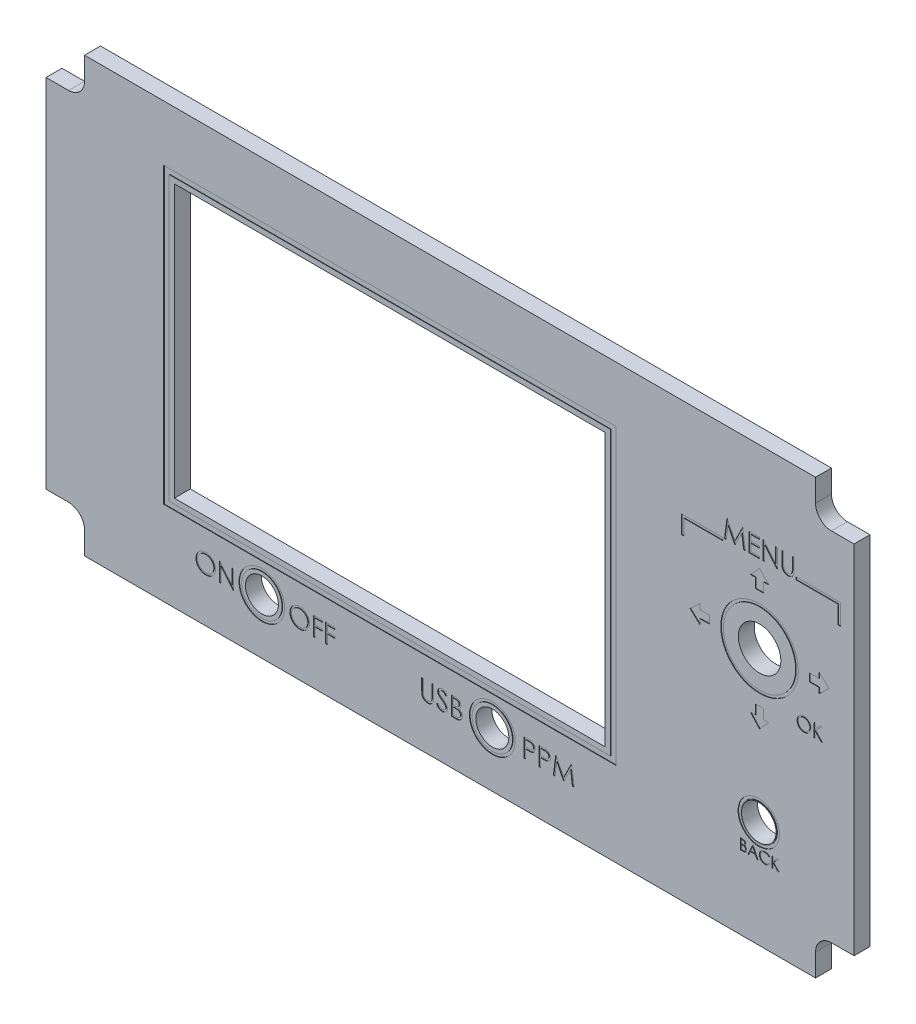
from build123d import *

# Parameters (mm, degrees)
ESQUISSE1_R             = 3.1
ESQUISSE1_R_2           = 4
ESQUISSE1_R_3           = 3.25
ESQUISSE1_W             = 81
ESQUISSE1_H             = 51.2
BOSS_EXTRU_1_DEPTH      = 3
GRAVURE_R               = 7.295589695
GRAVURE_R_2             = 6.795589695
GRAVURE_R_3             = 3.892751957
GRAVURE_R_4             = 3.392751957
GRAVURE_R_5             = 4.3
GRAVURE_R_6             = 3.8
GRAVURE_W               = 85
GRAVURE_H               = 55.2
GRAVURE_W_2             = 83
GRAVURE_H_2             = 53.2
ENL_V_MAT_EXTRU_1_DEPTH = 0.1


with BuildPart() as part:
    # Esquisse1 → Boss.-Extru.1 (new body)
    with BuildSketch(Plane.XY.offset(3.8)):
        with BuildLine():
            Line((-115.589634865, 32.662850462), (-119.832275552, 32.662850462))
            Line((-119.832275552, 32.662850462), (-119.832275552, -34.39608502))
            Line((-119.832275552, -34.39608502), (-115.589634865, -34.39608502))
            ThreePointArc((-115.589634865, -34.39608502), (-113.468314521, -35.274764676), (-112.589634865, -37.39608502))
            Line((-112.589634865, -37.39608502), (-112.589634865, -41.638725707))
            Line((-112.589634865, -41.638725707), (24.868962854, -41.638725707))
            Line((24.868962854, -41.638725707), (24.868962854, -37.400194893))
            ThreePointArc((24.868962854, -37.400194893), (25.74764251, -35.278874549), (27.868962854, -34.400194893))
            Line((27.868962854, -34.400194893), (32.107493668, -34.400194893))
            Line((32.107493668, -34.400194893), (32.107493668, 32.662850462))
            Line((32.107493668, 32.662850462), (27.864852981, 32.662850462))
            ThreePointArc((27.864852981, 32.662850462), (25.743532637, 33.541530119), (24.864852981, 35.662850462))
            Line((24.864852981, 35.662850462), (24.864852981, 39.905491149))
            Line((24.864852981, 39.905491149), (-112.589634865, 39.905491149))
            Line((-112.589634865, 39.905491149), (-112.589634865, 35.662850462))
            ThreePointArc((-112.589634865, 35.662850462), (-113.468314521, 33.541530119), (-115.589634865, 32.662850462))
        make_face()
        with Locations((-35.905557573, -31.316718293)):
            Circle(ESQUISSE1_R, mode=Mode.SUBTRACT)
        with Locations((-79.237508709, -31.316718293)):
            Circle(ESQUISSE1_R, mode=Mode.SUBTRACT)
        with Locations((14.345224597, 6.749852674)):
            Circle(ESQUISSE1_R_2, mode=Mode.SUBTRACT)
        with Locations((14.194599357, -21.638725707)):
            Circle(ESQUISSE1_R_3, mode=Mode.SUBTRACT)
        with Locations((-55.194417438, 1.821428571)):
            Rectangle(ESQUISSE1_W, ESQUISSE1_H, mode=Mode.SUBTRACT)
    extrude(amount=BOSS_EXTRU_1_DEPTH)

    # Gravure → Enlèv. mat.-Extru.1 (cut)
    # profile 1 of 32: a face of its own
    with BuildSketch(Plane.XY.offset(6.8)):
        with Locations((14.345224597, 6.749852674)):
            Circle(GRAVURE_R)
        with Locations((14.345224597, 6.749852674)):
            Circle(GRAVURE_R_2, mode=Mode.SUBTRACT)
    # profile 2 of 32: a face of its own
    with BuildSketch(Plane.XY.offset(6.8)):
        with Locations((14.194599357, -21.638725707)):
            Circle(GRAVURE_R_3)
        with Locations((14.194599357, -21.638725707)):
            Circle(GRAVURE_R_4, mode=Mode.SUBTRACT)
    # profile 3 of 32: a face of its own
    with BuildSketch(Plane.XY.offset(6.8)):
        with Locations((-79.237508709, -31.316718293)):
            Circle(GRAVURE_R_5)
        with Locations((-79.237508709, -31.316718293)):
            Circle(GRAVURE_R_6, mode=Mode.SUBTRACT)
    # profile 4 of 32: a face of its own
    with BuildSketch(Plane.XY.offset(6.8)):
        with Locations((-35.905557573, -31.316718293)):
            Circle(GRAVURE_R_5)
        with Locations((-35.905557573, -31.316718293)):
            Circle(GRAVURE_R_6, mode=Mode.SUBTRACT)
    # profile 5 of 32: a face of its own
    with BuildSketch(Plane.XY.offset(6.8)):
        Polygon((-0.376307372, 21.359912167), (-0.376307372, 17.961619409), (0.123692628, 17.961619409), (0.123692628, 20.859912167), (7.485840066, 20.859912167), (7.485840066, 21.359912167), align=None)
    # profile 6 of 32: a face of its own
    with BuildSketch(Plane.XY.offset(6.8)):
        Polygon((13.608406502, 16.139308456), (15.082042692, 16.139308456), (15.082042692, 17.961619409), (16.066756566, 17.961619409), (14.345224597, 19.835578794), (12.623692628, 17.961619409), (13.608406502, 17.961619409), align=None)
    # profile 7 of 32: a face of its own
    with BuildSketch(Plane.XY.offset(6.8)):
        Polygon((25.556991332, 6.013034579), (23.734680379, 6.013034579), (23.734680379, 7.48667077), (25.556991332, 7.48667077), (25.556991332, 8.471384644), (27.430950717, 6.749852674), (25.556991332, 5.028320705), align=None)
    # profile 8 of 32: a face of its own
    with BuildSketch(Plane.XY.offset(6.8)):
        Polygon((13.608406502, -4.46191406), (13.608406502, -2.639603107), (15.082042692, -2.639603107), (15.082042692, -4.46191406), (16.066756566, -4.46191406), (14.345224597, -6.335873445), (12.623692628, -4.46191406), align=None)
    # profile 9 of 32: a face of its own
    with BuildSketch(Plane.XY.offset(6.8)):
        Polygon((3.133457862, 7.48667077), (4.955768816, 7.48667077), (4.955768816, 6.013034579), (3.133457862, 6.013034579), (3.133457862, 5.028320705), (1.259498478, 6.749852674), (3.133457862, 8.471384644), align=None)
    # profile 10 of 32: a face of its own
    with BuildSketch(Plane.XY.offset(6.8)):
        Polygon((21.204609129, 21.359912167), (29.066756566, 21.359912167), (29.066756566, 17.961619409), (29.566756566, 17.961619409), (29.566756566, 21.859912167), (21.204609129, 21.859912167), align=None)
    # profile 11 of 32: a face of its own
    with BuildSketch(Plane.XY.offset(6.8)):
        with Locations((-55.194417438, 1.821428571)):
            Rectangle(GRAVURE_W, GRAVURE_H)
        with Locations((-55.194417438, 1.821428571)):
            Rectangle(GRAVURE_W_2, GRAVURE_H_2, mode=Mode.SUBTRACT)
    # profile 12 of 32: a face of its own
    with BuildSketch(Plane.XY.offset(6.8)):
        Polygon((7.755070835, 21.359912167), (8.217110098, 24.859912167), (8.261981893, 24.859912167), (9.706993912, 21.988117295), (11.148500322, 24.859912167), (11.194073239, 24.859912167), (11.658916989, 21.359912167), (11.343412181, 21.359912167), (11.008275963, 23.878341654), (9.744854489, 21.359912167), (9.674041187, 21.359912167), (8.405711861, 23.883950628), (8.071276764, 21.359912167), align=None)
    # profile 13 of 32: a face of its own
    with BuildSketch(Plane.XY.offset(6.8)):
        Polygon((12.376865707, 24.859912167), (14.351224681, 24.859912167), (14.351224681, 24.500937808), (12.690968271, 24.500937808), (12.690968271, 23.424014731), (14.351224681, 23.424014731), (14.351224681, 23.065040372), (12.690968271, 23.065040372), (12.690968271, 21.718886526), (14.351224681, 21.718886526), (14.351224681, 21.359912167), (12.376865707, 21.359912167), align=None)
    # profile 14 of 32: a face of its own
    with BuildSketch(Plane.XY.offset(6.8)):
        Polygon((14.979429809, 21.359912167), (14.979429809, 24.859912167), (15.045335258, 24.859912167), (17.357634937, 22.105204634), (17.357634937, 24.859912167), (17.671737502, 24.859912167), (17.671737502, 21.359912167), (17.600223079, 21.359912167), (15.293532373, 24.108309602), (15.293532373, 21.359912167), align=None)
    # profile 15 of 32: a face of its own
    with BuildSketch(Plane.XY.offset(6.8)):
        with BuildLine():
            Line((18.569173399, 24.859912167), (18.883275963, 24.859912167))
            Line((18.883275963, 24.859912167), (18.883275963, 22.762856878))
            add(Edge.make_bspline(
                [(18.883275963, 22.762856878), (18.883229219, 22.733176142), (18.883140514, 22.676851831), (18.883733028, 22.596683531), (18.885392397, 22.525411072), (18.886438556, 22.462759724), (18.88876589, 22.409016977), (18.890663937, 22.363891666), (18.893104493, 22.327597464), (18.896037611, 22.306416538), (18.897298399, 22.297312006)],
                knots=[0, 0, 0, 0, 1.528628734, 2.90083645, 4.128790002, 5.200304208, 6.127813768, 6.898992206, 7.526736466, 8, 8, 8, 8], degree=3))
            add(Edge.make_bspline(
                [(18.897298399, 22.297312006), (18.902475858, 22.264465243), (18.912539044, 22.200622514), (18.938185422, 22.109714232), (18.974002923, 22.027782774), (19.016445966, 21.952271483), (19.072378577, 21.885282123), (19.139382112, 21.82357047), (19.220559881, 21.769598665), (19.310820487, 21.720247853), (19.408105724, 21.680582771), (19.50751699, 21.650589407), (19.60755997, 21.632310507), (19.674536135, 21.630193968), (19.707795194, 21.629142936)],
                knots=[0, 0, 0, 0, 1.035780045, 2.013197591, 2.933192213, 3.817615948, 4.702609284, 5.640816605, 6.646850145, 7.73207398, 8.84249596, 9.914020372, 10.964143139, 12, 12, 12, 12], degree=3))
            add(Edge.make_bspline(
                [(19.707795194, 21.629142936), (19.736348934, 21.630216786), (19.793291496, 21.632358284), (19.877897927, 21.645619715), (19.960298036, 21.669520281), (20.040898715, 21.700360039), (20.1164497, 21.741107631), (20.186993142, 21.78817847), (20.249957076, 21.843389346), (20.307415074, 21.904489691), (20.35745001, 21.973429491), (20.400821151, 22.048707629), (20.436347081, 22.131456975), (20.453890606, 22.189611398), (20.462903367, 22.219487487)],
                knots=[0, 0, 0, 0, 0.994687771, 1.983630487, 2.973142513, 3.978332533, 4.983357753, 5.956394766, 6.925816176, 7.893390482, 8.871859704, 9.88551698, 10.913711441, 12, 12, 12, 12], degree=3))
            add(Edge.make_bspline(
                [(20.462903367, 22.219487487), (20.465903492, 22.231836061), (20.47258898, 22.259353661), (20.478836025, 22.305874952), (20.485342551, 22.360764316), (20.489857121, 22.424416129), (20.494258341, 22.496617101), (20.496891414, 22.577743359), (20.498108447, 22.66750032), (20.498471127, 22.730137481), (20.498660579, 22.762856878)],
                knots=[0, 0, 0, 0, 0.558680831, 1.244966039, 2.062412453, 2.990489873, 4.051219941, 5.244515665, 6.560634259, 8, 8, 8, 8], degree=3))
            Line((20.498660579, 22.762856878), (20.498660579, 24.859912167))
            Line((20.498660579, 24.859912167), (20.812763143, 24.859912167))
            Line((20.812763143, 24.859912167), (20.812763143, 22.746029955))
            add(Edge.make_bspline(
                [(20.812763143, 22.746029955), (20.812509022, 22.707931576), (20.812013091, 22.633580273), (20.807712514, 22.524628914), (20.800855515, 22.421275933), (20.791167427, 22.323507436), (20.778330423, 22.231673277), (20.764055203, 22.144968509), (20.74587567, 22.064015516), (20.724642269, 21.988183099), (20.700368721, 21.915997585), (20.668927572, 21.847488971), (20.633503072, 21.780574571), (20.591488419, 21.716266462), (20.544277037, 21.654279909), (20.490825356, 21.594990834), (20.432901195, 21.537451788), (20.369541636, 21.483138721), (20.30179111, 21.433330045), (20.229851153, 21.389532273), (20.154274383, 21.352508656), (20.075257257, 21.322032732), (19.992766054, 21.299118132), (19.906798694, 21.282042977), (19.817159501, 21.272340679), (19.756194845, 21.270898749), (19.725323239, 21.270168577)],
                knots=[0, 0, 0, 0, 1.316592851, 2.569410997, 3.76748051, 4.895814652, 5.963796859, 6.97159953, 7.931736103, 8.829262218, 9.692595152, 10.560224239, 11.431080259, 12.30701507, 13.211635791, 14.121146779, 15.063487852, 16.031507147, 17.00238618, 17.966455255, 18.938106653, 19.907068911, 20.888905087, 21.893141452, 22.933117798, 24, 24, 24, 24], degree=3))
            add(Edge.make_bspline(
                [(19.725323239, 21.270168577), (19.691654136, 21.270953342), (19.625595477, 21.272493049), (19.52825741, 21.281315799), (19.434943214, 21.297934193), (19.344667337, 21.319094137), (19.25865884, 21.348277874), (19.175765395, 21.382375999), (19.097406714, 21.424253259), (19.022311585, 21.470846652), (18.952486829, 21.52327129), (18.888389426, 21.580411464), (18.829913556, 21.641351842), (18.778044859, 21.706752208), (18.731923975, 21.776103915), (18.692193761, 21.849603154), (18.658080517, 21.927221471), (18.64047395, 21.981174671), (18.631573239, 22.008449827)],
                knots=[0, 0, 0, 0, 1.13879206, 2.234305948, 3.301075583, 4.341971843, 5.366689343, 6.369221514, 7.369726634, 8.367512178, 9.355451585, 10.318319045, 11.268648973, 12.207971039, 13.137398894, 14.081662264, 15.030215811, 16, 16, 16, 16], degree=3))
            add(Edge.make_bspline(
                [(18.631573239, 22.008449827), (18.626396081, 22.027082401), (18.615166709, 22.06749687), (18.603141412, 22.134383359), (18.59303233, 22.211398276), (18.583526772, 22.298546895), (18.577917814, 22.395896761), (18.573000375, 22.503405677), (18.569138756, 22.621203639), (18.569161529, 22.703258155), (18.569173399, 22.746029955)],
                knots=[0, 0, 0, 0, 0.625038921, 1.35572334, 2.194682327, 3.136881307, 4.189498639, 5.346923369, 6.617055217, 8, 8, 8, 8], degree=3))
            Line((18.569173399, 22.746029955), (18.569173399, 24.859912167))
        make_face()
    # profile 16 of 32: a face of its own
    with BuildSketch(Plane.XY.offset(6.8)):
        with BuildLine():
            Line((10.730106088, -25.821967935), (11.120330447, -25.821967935))
            add(Edge.make_bspline(
                [(11.120330447, -25.821967935), (11.139432435, -25.822068363), (11.176456841, -25.822263019), (11.230296522, -25.825281952), (11.280724414, -25.829398334), (11.327755141, -25.835929816), (11.371366971, -25.843810831), (11.411691335, -25.853354726), (11.448600005, -25.864798505), (11.492664426, -25.88299638), (11.542904803, -25.910038191), (11.597303885, -25.949997371), (11.643820593, -25.998873064), (11.68392706, -26.05400601), (11.715813414, -26.114655023), (11.738881584, -26.179374559), (11.753486084, -26.24732984), (11.754988047, -26.293983085), (11.755747114, -26.317560883)],
                knots=[0, 0, 0, 0, 1.001505555, 1.941167018, 2.826882275, 3.653841531, 4.429895133, 5.150066043, 5.825578002, 6.45369114, 7.647487171, 8.808567382, 9.977351308, 11.170798116, 12.373658725, 13.556498008, 14.765093433, 16, 16, 16, 16], degree=3))
            add(Edge.make_bspline(
                [(11.755747114, -26.317560883), (11.755122418, -26.339648058), (11.753894831, -26.383051439), (11.742156111, -26.446533787), (11.723778586, -26.506963055), (11.69823273, -26.564118704), (11.665031589, -26.61670934), (11.625683978, -26.665159206), (11.57821152, -26.707416953), (11.542643954, -26.731041469), (11.524577242, -26.743041653)],
                knots=[0, 0, 0, 0, 1.044552857, 2.05264487, 3.044412934, 4.028983338, 5.005914585, 5.980388656, 6.974128949, 8, 8, 8, 8], degree=3))
            add(Edge.make_bspline(
                [(11.524577242, -26.743041653), (11.547297487, -26.751764509), (11.590766942, -26.768453494), (11.650587521, -26.797959474), (11.702127432, -26.830052108), (11.745782944, -26.86509888), (11.783118747, -26.902875343), (11.815720428, -26.943935409), (11.843538356, -26.988814699), (11.867374312, -27.03704529), (11.885973602, -27.088134701), (11.89990269, -27.141603716), (11.907884089, -27.197260604), (11.909019884, -27.235137964), (11.909593268, -27.254259601)],
                knots=[0, 0, 0, 0, 1.27268992, 2.434971085, 3.483601985, 4.442670788, 5.356604649, 6.2567628, 7.179492994, 8.113709626, 9.066344395, 10.018646069, 10.999752585, 12, 12, 12, 12], degree=3))
            add(Edge.make_bspline(
                [(11.909593268, -27.254259601), (11.90903507, -27.273783528), (11.907936801, -27.312197401), (11.89983396, -27.368628907), (11.88611447, -27.422557448), (11.867216672, -27.474331838), (11.842552492, -27.523851915), (11.812536513, -27.57117378), (11.776747048, -27.615821969), (11.736711123, -27.658292611), (11.691418468, -27.696479918), (11.642552322, -27.730488893), (11.589497282, -27.758458071), (11.533124714, -27.781952941), (11.472802248, -27.799899911), (11.408800758, -27.812455668), (11.341175443, -27.820915689), (11.294769871, -27.821611235), (11.270971473, -27.821967935)],
                knots=[0, 0, 0, 0, 0.978564426, 1.925352924, 2.850884081, 3.763762016, 4.682927383, 5.618979971, 6.567305752, 7.547517671, 8.540179244, 9.531824382, 10.526200242, 11.540722885, 12.589160233, 13.674978461, 14.80764778, 16, 16, 16, 16], degree=3))
            Line((11.270971473, -27.821967935), (10.730106088, -27.821967935))
            Line((10.730106088, -27.821967935), (10.730106088, -25.821967935))
        make_face()
        with BuildLine():
            Line((10.909593268, -26.02709614), (10.909593268, -26.668121781))
            Line((10.909593268, -26.668121781), (11.030186217, -26.668121781))
            add(Edge.make_bspline(
                [(11.030186217, -26.668121781), (11.0478141, -26.667893253), (11.081874762, -26.667451692), (11.131200417, -26.666186825), (11.176986142, -26.662645086), (11.219152904, -26.659104365), (11.2576343, -26.653347457), (11.292345078, -26.646494816), (11.323829991, -26.639247441), (11.360138303, -26.62692202), (11.401322845, -26.608706206), (11.445227476, -26.580436585), (11.483932887, -26.546765526), (11.516616994, -26.507913548), (11.543366406, -26.46513287), (11.561945672, -26.419106082), (11.57454412, -26.370980292), (11.575682138, -26.33794129), (11.576259935, -26.321166653)],
                knots=[0, 0, 0, 0, 1.156816544, 2.235205308, 3.236616184, 4.169592532, 5.011045266, 5.787822928, 6.49130361, 7.128639758, 8.301311294, 9.436451833, 10.541879658, 11.654887649, 12.756523258, 13.837046038, 14.901820046, 16, 16, 16, 16], degree=3))
            add(Edge.make_bspline(
                [(11.576259935, -26.321166653), (11.57595926, -26.310066212), (11.575369455, -26.288291485), (11.570538996, -26.256548997), (11.562328953, -26.226695424), (11.551783643, -26.198321646), (11.537047249, -26.172314875), (11.519696699, -26.147775906), (11.498733447, -26.12554041), (11.474872126, -26.104757839), (11.447438627, -26.086332395), (11.416449318, -26.070194816), (11.381484931, -26.057200086), (11.343134728, -26.045819428), (11.300808392, -26.037826117), (11.254994362, -26.031167038), (11.205317379, -26.0277769), (11.170948749, -26.027328121), (11.153183012, -26.02709614)],
                knots=[0, 0, 0, 0, 0.91205012, 1.789085906, 2.630437955, 3.453916878, 4.269457761, 5.079663411, 5.91843418, 6.774407191, 7.675494373, 8.627863946, 9.638891023, 10.736472738, 11.911756761, 13.175263542, 14.539845004, 16, 16, 16, 16], degree=3))
            Line((11.153183012, -26.02709614), (10.909593268, -26.02709614))
        make_face(mode=Mode.SUBTRACT)
        with BuildLine():
            Line((10.909593268, -26.873249986), (10.909593268, -27.616839729))
            Line((10.909593268, -27.616839729), (11.165202242, -27.616839729))
            add(Edge.make_bspline(
                [(11.165202242, -27.616839729), (11.183498771, -27.616620445), (11.218762919, -27.616197804), (11.269677908, -27.614818058), (11.316868253, -27.611679615), (11.360118616, -27.60673913), (11.399896018, -27.601380016), (11.435723277, -27.59417357), (11.467890816, -27.585917021), (11.50519042, -27.573154637), (11.547192425, -27.553328082), (11.592455771, -27.523434238), (11.632699325, -27.487820919), (11.666873758, -27.446603254), (11.69488118, -27.401785353), (11.715255726, -27.354273724), (11.72782193, -27.304853423), (11.72934317, -27.271158159), (11.730106088, -27.254259601)],
                knots=[0, 0, 0, 0, 1.160039823, 2.235823828, 3.228722157, 4.157150951, 4.99529583, 5.772374946, 6.472645482, 7.099169577, 8.269452708, 9.405989375, 10.527446681, 11.663510218, 12.788923519, 13.866172445, 14.929861265, 16, 16, 16, 16], degree=3))
            add(Edge.make_bspline(
                [(11.730106088, -27.254259601), (11.729948315, -27.243691978), (11.729635312, -27.222727189), (11.72491496, -27.191918149), (11.718049892, -27.162074793), (11.709174787, -27.133116084), (11.696249377, -27.105565583), (11.681159923, -27.078878406), (11.663467693, -27.053019275), (11.635899598, -27.020326559), (11.595801322, -26.982659694), (11.538826021, -26.945781122), (11.474041851, -26.916039518), (11.427054712, -26.903411245), (11.402782371, -26.896887806)],
                knots=[0, 0, 0, 0, 0.723448775, 1.435228256, 2.130040452, 2.821711965, 3.505591119, 4.210454504, 4.921174351, 5.648778258, 7.137944449, 8.670945889, 10.280296675, 12, 12, 12, 12], degree=3))
            add(Edge.make_bspline(
                [(11.402782371, -26.896887806), (11.393051459, -26.894913473), (11.371952834, -26.89063271), (11.337548503, -26.886114022), (11.298270863, -26.882088274), (11.254029219, -26.879110469), (11.204767596, -26.876032445), (11.150380785, -26.874835404), (11.091090891, -26.873407255), (11.049952392, -26.87330375), (11.028583653, -26.873249986)],
                knots=[0, 0, 0, 0, 0.634451884, 1.375622551, 2.216452059, 3.157844607, 4.20941857, 5.370758133, 6.634282058, 8, 8, 8, 8], degree=3))
            Line((11.028583653, -26.873249986), (10.909593268, -26.873249986))
        make_face(mode=Mode.SUBTRACT)
    # profile 17 of 32: a face of its own
    with BuildSketch(Plane.XY.offset(6.8)):
        Polygon((13.140362499, -25.821967935), (14.063439422, -27.821967935), (13.868327242, -27.821967935), (13.572654165, -27.180942294), (12.666003524, -27.180942294), (12.361916986, -27.821967935), (12.166003524, -27.821967935), (13.114721473, -25.821967935), align=None)
        Polygon((13.125538781, -26.211791653), (12.763359294, -26.975814088), (13.478102883, -26.975814088), align=None, mode=Mode.SUBTRACT)
    # profile 18 of 32: a face of its own
    with BuildSketch(Plane.XY.offset(6.8)):
        with BuildLine():
            Line((16.268567627, -26.188955114), (16.111516345, -26.309147422))
            add(Edge.make_bspline(
                [(16.111516345, -26.309147422), (16.10031298, -26.295795439), (16.078057296, -26.269271487), (16.042252038, -26.232026033), (16.004936813, -26.197131598), (15.966125887, -26.164421953), (15.925120676, -26.135040944), (15.882914505, -26.107457456), (15.838801336, -26.082733035), (15.777800345, -26.052754185), (15.698001575, -26.021470668), (15.597547381, -25.99524025), (15.492683896, -25.978542436), (15.42114241, -25.976733955), (15.384753524, -25.975814088)],
                knots=[0, 0, 0, 0, 0.757959112, 1.505699292, 2.245454638, 2.979532153, 3.711538275, 4.438200793, 5.171680507, 5.909471876, 7.393775596, 8.890124382, 10.418191784, 12, 12, 12, 12], degree=3))
            add(Edge.make_bspline(
                [(15.384753524, -25.975814088), (15.364705925, -25.976044924), (15.324796786, -25.976504453), (15.265569087, -25.982566811), (15.207447344, -25.991087502), (15.150469363, -26.003730544), (15.094707672, -26.019714898), (15.039797728, -26.038815134), (14.986534528, -26.062446471), (14.934181249, -26.088565477), (14.8840217, -26.118066874), (14.836561673, -26.150245932), (14.791974263, -26.184742559), (14.750224199, -26.221686048), (14.7112688, -26.260910025), (14.675390336, -26.302832506), (14.642712959, -26.347319463), (14.612588945, -26.393784267), (14.58561024, -26.442091576), (14.563021737, -26.492420188), (14.54301881, -26.543908247), (14.527190672, -26.597137482), (14.514662376, -26.651733348), (14.506017997, -26.70784237), (14.500024585, -26.765347329), (14.499567341, -26.804324079), (14.499336858, -26.82397114)],
                knots=[0, 0, 0, 0, 1.054917814, 2.100044995, 3.131103042, 4.146048494, 5.169673617, 6.183595914, 7.203665975, 8.234915748, 9.262203917, 10.264457458, 11.251630812, 12.227803204, 13.197192746, 14.159520551, 15.12972552, 16.100847026, 17.073214652, 18.039054194, 19.002613845, 19.979014051, 20.95965708, 21.949030935, 22.966165397, 24, 24, 24, 24], degree=3))
            add(Edge.make_bspline(
                [(14.499336858, -26.82397114), (14.500057897, -26.853531894), (14.501473562, -26.911570514), (14.514072611, -26.996582291), (14.533218377, -27.078022676), (14.561912992, -27.155382586), (14.597295307, -27.229615934), (14.642004228, -27.299466707), (14.693785106, -27.365990458), (14.753370489, -27.427615), (14.818745241, -27.483908557), (14.888886905, -27.533480318), (14.963620783, -27.574803108), (15.042121715, -27.609189363), (15.12499378, -27.635621779), (15.212087953, -27.654229849), (15.303214807, -27.666368238), (15.365483036, -27.667530346), (15.397173396, -27.668121781)],
                knots=[0, 0, 0, 0, 1.029171465, 2.020641659, 2.987623507, 3.938342917, 4.889210282, 5.84687017, 6.821220943, 7.821438502, 8.827599549, 9.822697543, 10.807740252, 11.797342354, 12.80366471, 13.83203677, 14.896651826, 16, 16, 16, 16], degree=3))
            add(Edge.make_bspline(
                [(15.397173396, -27.668121781), (15.432089218, -27.667156764), (15.500811909, -27.665257379), (15.601593639, -27.64916638), (15.698071219, -27.623076141), (15.79024984, -27.586563043), (15.877869638, -27.539097164), (15.961067729, -27.48155552), (16.039914341, -27.413390758), (16.087326502, -27.361343256), (16.111516345, -27.334788447)],
                knots=[0, 0, 0, 0, 1.028121516, 2.023589091, 2.998037872, 3.967518031, 4.937445131, 5.927275754, 6.942489185, 8, 8, 8, 8], degree=3))
            Line((16.111516345, -27.334788447), (16.268567627, -27.453778832))
            add(Edge.make_bspline(
                [(16.268567627, -27.453778832), (16.255928707, -27.470086519), (16.230711407, -27.50262378), (16.189878254, -27.548493328), (16.146862656, -27.591638491), (16.101345107, -27.631711418), (16.053849226, -27.669513969), (16.003522191, -27.703972159), (15.951025601, -27.73556695), (15.896537327, -27.764496621), (15.840115263, -27.790163619), (15.781827014, -27.812137201), (15.721923828, -27.831065709), (15.660402966, -27.846638244), (15.597136819, -27.858793149), (15.532353691, -27.866918678), (15.465913763, -27.872485486), (15.421090093, -27.872992867), (15.398375319, -27.873249986)],
                knots=[0, 0, 0, 0, 0.986787822, 1.968848986, 2.935600012, 3.899624008, 4.868462664, 5.837806735, 6.815139263, 7.798259679, 8.787526145, 9.778297419, 10.776456485, 11.791383307, 12.812564526, 13.85620153, 14.913611965, 16, 16, 16, 16], degree=3))
            add(Edge.make_bspline(
                [(15.398375319, -27.873249986), (15.376864652, -27.873100276), (15.334329972, -27.872804243), (15.271530686, -27.868008719), (15.210393782, -27.861466012), (15.151093996, -27.851614508), (15.093307725, -27.839989171), (15.037558819, -27.824405596), (14.983298699, -27.806948929), (14.930745362, -27.786431794), (14.879854105, -27.76327969), (14.830789069, -27.737113085), (14.783572822, -27.708152019), (14.737741153, -27.67703487), (14.693971105, -27.642762126), (14.651883377, -27.605809764), (14.611241962, -27.566302329), (14.58609757, -27.537813841), (14.573455447, -27.523490371)],
                knots=[0, 0, 0, 0, 1.114604814, 2.203992996, 3.262667896, 4.300477797, 5.318619304, 6.316056647, 7.298880507, 8.271930387, 9.238335007, 10.195173496, 11.151986948, 12.108099108, 13.064862484, 14.031167946, 15.010108607, 16, 16, 16, 16], degree=3))
            add(Edge.make_bspline(
                [(14.573455447, -27.523490371), (14.553206508, -27.498609691), (14.512953093, -27.449148714), (14.461452702, -27.368985296), (14.417368385, -27.285289177), (14.381725002, -27.197620646), (14.353860583, -27.106176425), (14.334557043, -27.010910416), (14.322013269, -26.911911592), (14.320578818, -26.844576284), (14.319849678, -26.810349345)],
                knots=[0, 0, 0, 0, 0.994628077, 1.977248131, 2.950237994, 3.925870899, 4.908910175, 5.911660606, 6.938484602, 8, 8, 8, 8], degree=3))
            add(Edge.make_bspline(
                [(14.319849678, -26.810349345), (14.32073836, -26.7743748), (14.322486787, -26.703597129), (14.337341527, -26.599726298), (14.361237982, -26.500211213), (14.395179061, -26.405237645), (14.43821069, -26.314306056), (14.491368755, -26.228111082), (14.554035694, -26.146101482), (14.625720018, -26.069521624), (14.704329924, -25.999499137), (14.788512104, -25.937895592), (14.878101788, -25.88662844), (14.972111988, -25.84377349), (15.071246664, -25.810833797), (15.175294303, -25.787774833), (15.284059397, -25.773422195), (15.358266498, -25.771607791), (15.395971473, -25.770685883)],
                knots=[0, 0, 0, 0, 1.032925535, 2.032216505, 3.007276963, 3.968222605, 4.92396291, 5.891752235, 6.871517503, 7.883894988, 8.900124299, 9.891468569, 10.874487609, 11.85992873, 12.854644235, 13.869047385, 14.917252991, 16, 16, 16, 16], degree=3))
            add(Edge.make_bspline(
                [(15.395971473, -25.770685883), (15.418951171, -25.770961391), (15.46443717, -25.77150673), (15.5317244, -25.776824526), (15.597234301, -25.785689444), (15.661012005, -25.797755769), (15.723367786, -25.812731382), (15.783825066, -25.832240123), (15.842738601, -25.854546713), (15.899736835, -25.880237265), (15.954546292, -25.909075403), (16.007149902, -25.940741473), (16.057129822, -25.975196219), (16.104837735, -26.012146605), (16.14947557, -26.052374353), (16.192310701, -26.09477298), (16.23188846, -26.140563736), (16.256318857, -26.172795127), (16.268567627, -26.188955114)],
                knots=[0, 0, 0, 0, 1.096760587, 2.17092713, 3.219439832, 4.250915756, 5.268269357, 6.278326846, 7.281116186, 8.274029601, 9.260640565, 10.235837813, 11.203064059, 12.156899882, 13.114053108, 14.069676657, 15.032185724, 16, 16, 16, 16], degree=3))
        make_face()
    # profile 19 of 32: a face of its own
    with BuildSketch(Plane.XY.offset(6.8)):
        Polygon((16.678824037, -25.821967935), (16.858311217, -25.821967935), (16.858311217, -26.583586524), (17.692045191, -25.821967935), (17.948054806, -25.821967935), (16.965282371, -26.719403832), (18.024977883, -27.821967935), (17.785795191, -27.821967935), (16.858311217, -26.856823704), (16.858311217, -27.821967935), (16.678824037, -27.821967935), align=None)
    # profile 20 of 32: a face of its own
    with BuildSketch(Plane.XY.offset(6.8)):
        with BuildLine():
            add(Edge.make_bspline(
                [(22.694993744, -0.075500543), (22.741285248, -0.076673028), (22.832205582, -0.078975886), (22.965830509, -0.096603817), (23.093398434, -0.127100524), (23.215948533, -0.16771694), (23.332014945, -0.221898644), (23.442471297, -0.287388036), (23.547054778, -0.364871221), (23.644355765, -0.45374924), (23.733396444, -0.550451707), (23.811843505, -0.653650214), (23.877588001, -0.762720787), (23.931577849, -0.877335666), (23.973933999, -0.997235644), (24.003161887, -1.123059931), (24.021831994, -1.253993281), (24.024014692, -1.343298185), (24.025121949, -1.388601505)],
                knots=[0, 0, 0, 0, 1.065120563, 2.091984664, 3.0946048, 4.079830382, 5.057816894, 6.036188127, 7.030412546, 8.04752943, 9.064399622, 10.05169764, 11.02544977, 11.989514704, 12.962713494, 13.945757189, 14.957906945, 16, 16, 16, 16], degree=3))
            add(Edge.make_bspline(
                [(24.025121949, -1.388601505), (24.024014855, -1.433571109), (24.021832643, -1.52221141), (24.003140659, -1.65231387), (23.973825659, -1.777378653), (23.931971183, -1.897196976), (23.878238698, -2.011895236), (23.812056433, -2.121171632), (23.734098426, -2.225061988), (23.645379246, -2.322428177), (23.548664216, -2.411712085), (23.444928311, -2.489511282), (23.336504511, -2.556457085), (23.221997577, -2.609873995), (23.102926122, -2.652568224), (22.978224463, -2.681677245), (22.848476924, -2.700453705), (22.759997636, -2.702609788), (22.715025795, -2.703705671)],
                knots=[0, 0, 0, 0, 1.043624062, 2.057103931, 3.04512605, 4.022047818, 4.998200453, 5.980619268, 6.982898556, 8.009068085, 9.034988726, 10.034168286, 11.015286542, 11.987931943, 12.962482838, 13.94673481, 14.956375938, 16, 16, 16, 16], degree=3))
            add(Edge.make_bspline(
                [(22.715025795, -2.703705671), (22.66972271, -2.702598966), (22.58041827, -2.700417357), (22.449320388, -2.681716353), (22.323407714, -2.652472565), (22.20304032, -2.61068011), (22.088151085, -2.556667803), (21.978515311, -2.490807532), (21.874573063, -2.412659574), (21.777186102, -2.323969163), (21.688079531, -2.227418055), (21.610394263, -2.123965015), (21.544519182, -2.015639689), (21.49068823, -1.902141458), (21.448070759, -1.784018999), (21.418995889, -1.660484372), (21.400184495, -1.532241868), (21.398016747, -1.444925512), (21.396916821, -1.400620735)],
                knots=[0, 0, 0, 0, 1.053102029, 2.075944431, 3.073151272, 4.055350789, 5.033113405, 6.020478099, 7.024410459, 8.052272461, 9.079885166, 10.07527673, 11.055994387, 12.023226415, 12.992069828, 13.970394897, 14.97016774, 16, 16, 16, 16], degree=3))
            add(Edge.make_bspline(
                [(21.396916821, -1.400620735), (21.397298703, -1.370883115), (21.398057651, -1.311783026), (21.407194574, -1.224021169), (21.420452932, -1.137670699), (21.439454298, -1.052977165), (21.464305489, -0.97014789), (21.493628366, -0.888611631), (21.529442541, -0.809194686), (21.569928718, -0.731520834), (21.615115724, -0.656800902), (21.665026973, -0.586172628), (21.717909379, -0.519043345), (21.775883232, -0.457152627), (21.837037836, -0.398700016), (21.902365249, -0.344583789), (21.971466852, -0.294315967), (22.04463998, -0.249015724), (22.120081605, -0.208044913), (22.197850732, -0.172886448), (22.27689114, -0.14271069), (22.357573032, -0.118252958), (22.439682155, -0.098944361), (22.523397715, -0.085796251), (22.608653019, -0.076636024), (22.666089676, -0.075880665), (22.694993744, -0.075500543)],
                knots=[0, 0, 0, 0, 1.037015668, 2.060948919, 3.074880161, 4.083647147, 5.086022904, 6.090072063, 7.104153813, 8.122640571, 9.144368836, 10.147691507, 11.138137339, 12.123020368, 13.103399296, 14.087645067, 15.080126199, 16.082011238, 17.087798457, 18.072939717, 19.057185487, 20.037253025, 21.01195951, 21.997135196, 22.992090687, 24, 24, 24, 24], degree=3))
        make_face()
        with BuildLine():
            add(Edge.make_bspline(
                [(22.706011372, -0.3319108), (22.682286634, -0.332200007), (22.635063968, -0.332775657), (22.564860727, -0.340358311), (22.495580775, -0.351165374), (22.427209802, -0.366580746), (22.360033881, -0.387583641), (22.293426851, -0.411755718), (22.227996099, -0.441199354), (22.163957629, -0.474465572), (22.101875432, -0.51128623), (22.043294931, -0.551980349), (21.988064471, -0.595593602), (21.936319281, -0.642227771), (21.888211301, -0.692120344), (21.842793657, -0.744514941), (21.801886813, -0.800909149), (21.764397115, -0.859773726), (21.730848658, -0.921031998), (21.701016261, -0.984039042), (21.676613398, -1.049308819), (21.656711701, -1.116133217), (21.640211836, -1.184406402), (21.629759033, -1.254646294), (21.622093062, -1.326499946), (21.621550315, -1.375058413), (21.621275795, -1.399619133)],
                knots=[0, 0, 0, 0, 1.008559885, 2.007477868, 2.99961109, 3.989939068, 4.984837346, 5.991145699, 7.001802488, 8.033829008, 9.059044045, 10.069351652, 11.065060232, 12.050310815, 13.029377138, 14.011219647, 14.996725999, 15.989392538, 16.977580475, 17.965360261, 18.951710183, 19.937753436, 20.929683414, 21.935841486, 22.955955122, 24, 24, 24, 24], degree=3))
            add(Edge.make_bspline(
                [(21.621275795, -1.399619133), (21.622186411, -1.435735005), (21.623977874, -1.506786098), (21.639661852, -1.610906201), (21.663820406, -1.710969262), (21.69943281, -1.806427769), (21.743968964, -1.898102257), (21.798988171, -1.985179474), (21.864173232, -2.067682956), (21.938218608, -2.14503672), (22.019163399, -2.215640866), (22.105115349, -2.277614729), (22.19515364, -2.330050622), (22.28951307, -2.37276853), (22.387689884, -2.406618343), (22.490316706, -2.429817365), (22.596709891, -2.445085548), (22.669231788, -2.446551802), (22.706011372, -2.447295415)],
                knots=[0, 0, 0, 0, 1.032063989, 2.030389145, 3.003944642, 3.970395727, 4.937377036, 5.913328081, 6.909231446, 7.93887556, 8.970685674, 9.976071282, 10.964166581, 11.944589148, 12.933237628, 13.927779006, 14.949070134, 16, 16, 16, 16], degree=3))
            add(Edge.make_bspline(
                [(22.706011372, -2.447295415), (22.730732445, -2.446955769), (22.779761757, -2.446282149), (22.85268713, -2.43949738), (22.924298709, -2.428617473), (22.994496052, -2.412952719), (23.063199489, -2.393347572), (23.130695777, -2.370056337), (23.196265984, -2.340998335), (23.260737297, -2.308892655), (23.322448898, -2.272292543), (23.381359993, -2.232979578), (23.435985693, -2.189430564), (23.487692172, -2.143489269), (23.535997664, -2.094229378), (23.58057551, -2.041714934), (23.621275605, -1.985614464), (23.658751066, -1.926839174), (23.692181968, -1.865413279), (23.721309896, -1.802177795), (23.746021408, -1.737288431), (23.76597034, -1.670651595), (23.781602812, -1.602393845), (23.792374184, -1.53242379), (23.799908783, -1.460881402), (23.800476695, -1.412492934), (23.800762975, -1.388100703)],
                knots=[0, 0, 0, 0, 1.047197238, 2.076906641, 3.100256066, 4.114471768, 5.12198147, 6.126382909, 7.136867548, 8.15857795, 9.17633901, 10.174870724, 11.156907918, 12.133735059, 13.104061851, 14.077631395, 15.04955518, 16.038496417, 17.029181396, 18.010275684, 18.986308667, 19.968651475, 20.955262928, 21.950658345, 22.966943676, 24, 24, 24, 24], degree=3))
            add(Edge.make_bspline(
                [(23.800762975, -1.388100703), (23.800476466, -1.363875343), (23.799908122, -1.315819879), (23.792377783, -1.244776437), (23.781591432, -1.175309857), (23.766046641, -1.107692855), (23.746010817, -1.041908195), (23.721305581, -0.978017661), (23.692173224, -0.915783235), (23.658738778, -0.855358738), (23.621156047, -0.797376782), (23.58008873, -0.741946487), (23.534827767, -0.690108815), (23.486666321, -0.640584033), (23.434401403, -0.594428398), (23.378269764, -0.551626598), (23.318952852, -0.511145687), (23.256147683, -0.474627429), (23.191330574, -0.440902977), (23.124820604, -0.412009403), (23.057371247, -0.387457889), (22.989154024, -0.3665172), (22.919594754, -0.35122575), (22.849163447, -0.340348571), (22.777957548, -0.332778296), (22.730069534, -0.332200883), (22.706011372, -0.3319108)],
                knots=[0, 0, 0, 0, 1.02996197, 2.043119294, 3.035359645, 4.018872909, 4.991431989, 5.957985074, 6.929999688, 7.912076566, 8.892894881, 9.867085534, 10.843653904, 11.817741046, 12.803660682, 13.806313499, 14.818574707, 15.856120519, 16.894564902, 17.924820532, 18.937903209, 19.946497019, 20.957711757, 21.963978472, 22.977135795, 24, 24, 24, 24], degree=3))
        make_face(mode=Mode.SUBTRACT)
    # profile 21 of 32: a face of its own
    with BuildSketch(Plane.XY.offset(6.8)):
        Polygon((24.537942462, -0.139603107), (24.762301436, -0.139603107), (24.762301436, -1.091626344), (25.804468904, -0.139603107), (26.124480924, -0.139603107), (24.896015379, -1.261397979), (26.22063477, -2.639603107), (25.921656404, -2.639603107), (24.762301436, -1.433172819), (24.762301436, -2.639603107), (24.537942462, -2.639603107), align=None)
    # profile 22 of 32: a face of its own
    with BuildSketch(Plane.XY.offset(6.8)):
        with BuildLine():
            add(Edge.make_bspline(
                [(-89.826488929, -29.658320061), (-89.761680823, -29.65996154), (-89.634392356, -29.663185541), (-89.447317459, -29.687864645), (-89.268722363, -29.730560035), (-89.097152225, -29.787423017), (-88.934659248, -29.863277402), (-88.780020355, -29.954962551), (-88.633603482, -30.06343901), (-88.4973821, -30.187868236), (-88.37272515, -30.32325169), (-88.262899264, -30.4677296), (-88.17085697, -30.620428403), (-88.095271183, -30.780889233), (-88.035972573, -30.948749201), (-87.995053529, -31.124903204), (-87.968915379, -31.308209894), (-87.965859602, -31.433236759), (-87.964309442, -31.496661407)],
                knots=[0, 0, 0, 0, 1.065120563, 2.091984664, 3.0946048, 4.079830382, 5.057816894, 6.036188127, 7.030412546, 8.04752943, 9.064399622, 10.05169764, 11.02544977, 11.989514704, 12.962713494, 13.945757189, 14.957906945, 16, 16, 16, 16], degree=3))
            add(Edge.make_bspline(
                [(-87.964309442, -31.496661407), (-87.965859375, -31.559618853), (-87.968914471, -31.683715274), (-87.995083249, -31.865858718), (-88.036124249, -32.040949414), (-88.094720515, -32.208695067), (-88.169945993, -32.369272631), (-88.262601164, -32.522259585), (-88.371742375, -32.667706083), (-88.495949226, -32.804018748), (-88.631350268, -32.929016219), (-88.776580535, -33.037935095), (-88.928373855, -33.131659219), (-89.088683563, -33.206442893), (-89.2553836, -33.266214814), (-89.429965923, -33.306967444), (-89.611612477, -33.333254487), (-89.735483481, -33.336273003), (-89.798444057, -33.33780724)],
                knots=[0, 0, 0, 0, 1.043624062, 2.057103931, 3.04512605, 4.022047818, 4.998200453, 5.980619268, 6.982898556, 8.009068085, 9.034988726, 10.034168286, 11.015286542, 11.987931943, 12.962482838, 13.94673481, 14.956375938, 16, 16, 16, 16], degree=3))
            add(Edge.make_bspline(
                [(-89.798444057, -33.33780724), (-89.861868376, -33.336257853), (-89.986894592, -33.333203599), (-90.170431628, -33.307022195), (-90.346709372, -33.266080891), (-90.515223723, -33.207571455), (-90.676068652, -33.131954224), (-90.829558735, -33.039749845), (-90.975077882, -32.930342704), (-91.111419629, -32.806176129), (-91.236168827, -32.671004577), (-91.344928203, -32.526170322), (-91.437153316, -32.374514865), (-91.512516648, -32.215617341), (-91.572181108, -32.050245899), (-91.612885926, -31.877297421), (-91.639221878, -31.697757915), (-91.642256725, -31.575515017), (-91.643796622, -31.51348833)],
                knots=[0, 0, 0, 0, 1.053102029, 2.075944431, 3.073151272, 4.055350789, 5.033113405, 6.020478099, 7.024410459, 8.052272461, 9.079885166, 10.07527673, 11.055994387, 12.023226415, 12.992069828, 13.970394897, 14.97016774, 16, 16, 16, 16], degree=3))
            add(Edge.make_bspline(
                [(-91.643796622, -31.51348833), (-91.643261986, -31.471855661), (-91.64219946, -31.389115537), (-91.629407767, -31.266248937), (-91.610846066, -31.145358279), (-91.584244153, -31.026787331), (-91.549452486, -30.910826347), (-91.508400459, -30.796675584), (-91.458260614, -30.68549186), (-91.401579966, -30.576748468), (-91.338318158, -30.472140563), (-91.268442408, -30.373260979), (-91.19440704, -30.279279983), (-91.113243646, -30.192632979), (-91.027627201, -30.110799322), (-90.936168823, -30.035036605), (-90.839426578, -29.964661655), (-90.736984199, -29.901241313), (-90.631365924, -29.843882179), (-90.522489146, -29.794660328), (-90.411832574, -29.752414266), (-90.298877927, -29.718173441), (-90.183925154, -29.691141405), (-90.06672337, -29.672734051), (-89.947365944, -29.659909734), (-89.866954625, -29.658852232), (-89.826488929, -29.658320061)],
                knots=[0, 0, 0, 0, 1.037015668, 2.060948919, 3.074880161, 4.083647147, 5.086022904, 6.090072063, 7.104153813, 8.122640571, 9.144368836, 10.147691507, 11.138137339, 12.123020368, 13.103399296, 14.087645067, 15.080126199, 16.082011238, 17.087798457, 18.072939717, 19.057185487, 20.037253025, 21.01195951, 21.997135196, 22.992090687, 24, 24, 24, 24], degree=3))
        make_face()
        with BuildLine():
            add(Edge.make_bspline(
                [(-89.81106425, -30.01729442), (-89.844278883, -30.01769931), (-89.910390616, -30.01850522), (-90.008675152, -30.029120935), (-90.105667086, -30.044250824), (-90.201386448, -30.065832345), (-90.295432738, -30.095236398), (-90.388682579, -30.129077306), (-90.480285633, -30.170298397), (-90.569939491, -30.216871101), (-90.656854566, -30.268420022), (-90.738867267, -30.325391789), (-90.816189911, -30.386450343), (-90.888633178, -30.45173818), (-90.95598435, -30.521587782), (-91.019569052, -30.594940218), (-91.076838633, -30.673892109), (-91.12932421, -30.756302516), (-91.17629205, -30.842064097), (-91.218057405, -30.93027396), (-91.252221414, -31.021651647), (-91.28008379, -31.115205804), (-91.303183601, -31.210788264), (-91.317817525, -31.309124113), (-91.328549885, -31.409719225), (-91.32930973, -31.477701079), (-91.329694057, -31.512086086)],
                knots=[0, 0, 0, 0, 1.008559885, 2.007477868, 2.99961109, 3.989939068, 4.984837346, 5.991145699, 7.001802488, 8.033829008, 9.059044045, 10.069351652, 11.065060232, 12.050310815, 13.029377138, 14.011219647, 14.996725999, 15.989392538, 16.977580475, 17.965360261, 18.951710183, 19.937753436, 20.929683414, 21.935841486, 22.955955122, 24, 24, 24, 24], degree=3))
            add(Edge.make_bspline(
                [(-91.329694057, -31.512086086), (-91.328419195, -31.562648307), (-91.325911148, -31.662119837), (-91.303953577, -31.807887981), (-91.270131603, -31.947976268), (-91.220274237, -32.081618177), (-91.157923622, -32.20996246), (-91.080896732, -32.331870565), (-90.989637646, -32.447375439), (-90.885974119, -32.555670708), (-90.772651413, -32.654516512), (-90.652318683, -32.741279921), (-90.526265075, -32.814690171), (-90.394161873, -32.874495243), (-90.256714334, -32.921884981), (-90.113036783, -32.954363612), (-89.964086323, -32.975739067), (-89.862555668, -32.977791823), (-89.81106425, -32.978832881)],
                knots=[0, 0, 0, 0, 1.032063989, 2.030389145, 3.003944642, 3.970395727, 4.937377036, 5.913328081, 6.909231446, 7.93887556, 8.970685674, 9.976071282, 10.964166581, 11.944589148, 12.933237628, 13.927779006, 14.949070134, 16, 16, 16, 16], degree=3))
            add(Edge.make_bspline(
                [(-89.81106425, -32.978832881), (-89.776454748, -32.978357377), (-89.707813712, -32.977414309), (-89.605718189, -32.967915632), (-89.505461978, -32.952683763), (-89.407185698, -32.930753107), (-89.311000886, -32.903305901), (-89.216506083, -32.870698173), (-89.124707793, -32.830016969), (-89.034447955, -32.785069017), (-88.948051713, -32.73382886), (-88.865576181, -32.67879071), (-88.789100201, -32.61782209), (-88.71671113, -32.553504277), (-88.649083441, -32.484540429), (-88.586674457, -32.411020207), (-88.529694325, -32.33247955), (-88.477228678, -32.250194144), (-88.430425415, -32.164197892), (-88.389646316, -32.075668214), (-88.3550502, -31.984823104), (-88.327121695, -31.891531533), (-88.305236234, -31.795970684), (-88.290156314, -31.698012606), (-88.279607875, -31.597853263), (-88.278812798, -31.530109407), (-88.278412006, -31.495960285)],
                knots=[0, 0, 0, 0, 1.047197238, 2.076906641, 3.100256066, 4.114471768, 5.12198147, 6.126382909, 7.136867548, 8.15857795, 9.17633901, 10.174870724, 11.156907918, 12.133735059, 13.104061851, 14.077631395, 15.04955518, 16.038496417, 17.029181396, 18.010275684, 18.986308667, 19.968651475, 20.955262928, 21.950658345, 22.966943676, 24, 24, 24, 24], degree=3))
            add(Edge.make_bspline(
                [(-88.278412006, -31.495960285), (-88.278813119, -31.462044781), (-88.279608801, -31.394767131), (-88.290151275, -31.295306312), (-88.305252166, -31.198053101), (-88.327014874, -31.103389298), (-88.355065027, -31.011290773), (-88.389652358, -30.921844025), (-88.430437657, -30.83471583), (-88.477245882, -30.750121533), (-88.529861705, -30.668946795), (-88.587355948, -30.591344382), (-88.650721297, -30.518771641), (-88.718147321, -30.449436947), (-88.791318207, -30.384819058), (-88.869902501, -30.324896537), (-88.952946179, -30.268223263), (-89.040873414, -30.217097701), (-89.131617368, -30.169883468), (-89.224731326, -30.129432465), (-89.319160425, -30.095060346), (-89.414664538, -30.06574338), (-89.512047516, -30.04433535), (-89.610651345, -30.0291073), (-89.710339603, -30.018508915), (-89.777382823, -30.017700536), (-89.81106425, -30.01729442)],
                knots=[0, 0, 0, 0, 1.02996197, 2.043119294, 3.035359645, 4.018872909, 4.991431989, 5.957985074, 6.929999688, 7.912076566, 8.892894881, 9.867085534, 10.843653904, 11.817741046, 12.803660682, 13.806313499, 14.818574707, 15.856120519, 16.894564902, 17.924820532, 18.937903209, 19.946497019, 20.957711757, 21.963978472, 22.977135795, 24, 24, 24, 24], degree=3))
        make_face(mode=Mode.SUBTRACT)
    # profile 23 of 32: a face of its own
    with BuildSketch(Plane.XY.offset(6.8)):
        Polygon((-87.246360724, -33.248063651), (-87.246360724, -29.748063651), (-87.180455275, -29.748063651), (-84.868155596, -32.502771183), (-84.868155596, -29.748063651), (-84.554053032, -29.748063651), (-84.554053032, -33.248063651), (-84.625567455, -33.248063651), (-86.93225816, -30.499666215), (-86.93225816, -33.248063651), align=None)
    # profile 24 of 32: a face of its own
    with BuildSketch(Plane.XY.offset(6.8)):
        with BuildLine():
            add(Edge.make_bspline(
                [(-72.150550011, -29.658320061), (-72.085741905, -29.65996154), (-71.958453438, -29.663185541), (-71.77137854, -29.687864645), (-71.592783445, -29.730560035), (-71.421213306, -29.787423017), (-71.25872033, -29.863277402), (-71.104081437, -29.954962551), (-70.957664563, -30.06343901), (-70.821443182, -30.187868236), (-70.696786232, -30.32325169), (-70.586960345, -30.4677296), (-70.494918052, -30.620428403), (-70.419332264, -30.780889233), (-70.360033655, -30.948749201), (-70.319114611, -31.124903204), (-70.292976461, -31.308209894), (-70.289920683, -31.433236759), (-70.288370524, -31.496661407)],
                knots=[0, 0, 0, 0, 1.065120563, 2.091984664, 3.0946048, 4.079830382, 5.057816894, 6.036188127, 7.030412546, 8.04752943, 9.064399622, 10.05169764, 11.02544977, 11.989514704, 12.962713494, 13.945757189, 14.957906945, 16, 16, 16, 16], degree=3))
            add(Edge.make_bspline(
                [(-70.288370524, -31.496661407), (-70.289920456, -31.559618853), (-70.292975553, -31.683715274), (-70.31914433, -31.865858718), (-70.36018533, -32.040949414), (-70.418781597, -32.208695067), (-70.494007075, -32.369272631), (-70.586662246, -32.522259585), (-70.695803457, -32.667706083), (-70.820010308, -32.804018748), (-70.95541135, -32.929016219), (-71.100641617, -33.037935095), (-71.252434937, -33.131659219), (-71.412744645, -33.206442893), (-71.579444682, -33.266214814), (-71.754027005, -33.306967444), (-71.935673559, -33.333254487), (-72.059544563, -33.336273003), (-72.122505139, -33.33780724)],
                knots=[0, 0, 0, 0, 1.043624062, 2.057103931, 3.04512605, 4.022047818, 4.998200453, 5.980619268, 6.982898556, 8.009068085, 9.034988726, 10.034168286, 11.015286542, 11.987931943, 12.962482838, 13.94673481, 14.956375938, 16, 16, 16, 16], degree=3))
            add(Edge.make_bspline(
                [(-72.122505139, -33.33780724), (-72.185929458, -33.336257853), (-72.310955674, -33.333203599), (-72.494492709, -33.307022195), (-72.670770453, -33.266080891), (-72.839284804, -33.207571455), (-73.000129734, -33.131954224), (-73.153619817, -33.039749845), (-73.299138964, -32.930342704), (-73.435480711, -32.806176129), (-73.560229909, -32.671004577), (-73.668989284, -32.526170322), (-73.761214398, -32.374514865), (-73.83657773, -32.215617341), (-73.89624219, -32.050245899), (-73.936947008, -31.877297421), (-73.96328296, -31.697757915), (-73.966317806, -31.575515017), (-73.967857703, -31.51348833)],
                knots=[0, 0, 0, 0, 1.053102029, 2.075944431, 3.073151272, 4.055350789, 5.033113405, 6.020478099, 7.024410459, 8.052272461, 9.079885166, 10.07527673, 11.055994387, 12.023226415, 12.992069828, 13.970394897, 14.97016774, 16, 16, 16, 16], degree=3))
            add(Edge.make_bspline(
                [(-73.967857703, -31.51348833), (-73.967323068, -31.471855661), (-73.966260541, -31.389115537), (-73.953468849, -31.266248937), (-73.934907148, -31.145358279), (-73.908305235, -31.026787331), (-73.873513568, -30.910826347), (-73.832461541, -30.796675584), (-73.782321695, -30.68549186), (-73.725641047, -30.576748468), (-73.662379239, -30.472140563), (-73.59250349, -30.373260979), (-73.518468121, -30.279279983), (-73.437304728, -30.192632979), (-73.351688283, -30.110799322), (-73.260229904, -30.035036605), (-73.16348766, -29.964661655), (-73.06104528, -29.901241313), (-72.955427005, -29.843882179), (-72.846550228, -29.794660328), (-72.735893656, -29.752414266), (-72.622939008, -29.718173441), (-72.507986236, -29.691141405), (-72.390784452, -29.672734051), (-72.271427025, -29.659909734), (-72.191015706, -29.658852232), (-72.150550011, -29.658320061)],
                knots=[0, 0, 0, 0, 1.037015668, 2.060948919, 3.074880161, 4.083647147, 5.086022904, 6.090072063, 7.104153813, 8.122640571, 9.144368836, 10.147691507, 11.138137339, 12.123020368, 13.103399296, 14.087645067, 15.080126199, 16.082011238, 17.087798457, 18.072939717, 19.057185487, 20.037253025, 21.01195951, 21.997135196, 22.992090687, 24, 24, 24, 24], degree=3))
        make_face()
        with BuildLine():
            add(Edge.make_bspline(
                [(-72.135125331, -30.01729442), (-72.168339965, -30.01769931), (-72.234451698, -30.01850522), (-72.332736234, -30.029120935), (-72.429728168, -30.044250824), (-72.52544753, -30.065832345), (-72.61949382, -30.095236398), (-72.712743661, -30.129077306), (-72.804346715, -30.170298397), (-72.894000572, -30.216871101), (-72.980915648, -30.268420022), (-73.062928349, -30.325391789), (-73.140250993, -30.386450343), (-73.21269426, -30.45173818), (-73.280045432, -30.521587782), (-73.343630133, -30.594940218), (-73.400899715, -30.673892109), (-73.453385292, -30.756302516), (-73.500353132, -30.842064097), (-73.542118487, -30.93027396), (-73.576282496, -31.021651647), (-73.604144872, -31.115205804), (-73.627244683, -31.210788264), (-73.641878607, -31.309124113), (-73.652610966, -31.409719225), (-73.653370812, -31.477701079), (-73.653755139, -31.512086086)],
                knots=[0, 0, 0, 0, 1.008559885, 2.007477868, 2.99961109, 3.989939068, 4.984837346, 5.991145699, 7.001802488, 8.033829008, 9.059044045, 10.069351652, 11.065060232, 12.050310815, 13.029377138, 14.011219647, 14.996725999, 15.989392538, 16.977580475, 17.965360261, 18.951710183, 19.937753436, 20.929683414, 21.935841486, 22.955955122, 24, 24, 24, 24], degree=3))
            add(Edge.make_bspline(
                [(-73.653755139, -31.512086086), (-73.652480277, -31.562648307), (-73.649972229, -31.662119837), (-73.628014659, -31.807887981), (-73.594192685, -31.947976268), (-73.544335318, -32.081618177), (-73.481984704, -32.20996246), (-73.404957813, -32.331870565), (-73.313698728, -32.447375439), (-73.210035201, -32.555670708), (-73.096712495, -32.654516512), (-72.976379765, -32.741279921), (-72.850326157, -32.814690171), (-72.718222954, -32.874495243), (-72.580775415, -32.921884981), (-72.437097864, -32.954363612), (-72.288147405, -32.975739067), (-72.18661675, -32.977791823), (-72.135125331, -32.978832881)],
                knots=[0, 0, 0, 0, 1.032063989, 2.030389145, 3.003944642, 3.970395727, 4.937377036, 5.913328081, 6.909231446, 7.93887556, 8.970685674, 9.976071282, 10.964166581, 11.944589148, 12.933237628, 13.927779006, 14.949070134, 16, 16, 16, 16], degree=3))
            add(Edge.make_bspline(
                [(-72.135125331, -32.978832881), (-72.10051583, -32.978357377), (-72.031874793, -32.977414309), (-71.929779271, -32.967915632), (-71.829523059, -32.952683763), (-71.731246779, -32.930753107), (-71.635061968, -32.903305901), (-71.540567165, -32.870698173), (-71.448768875, -32.830016969), (-71.358509037, -32.785069017), (-71.272112795, -32.73382886), (-71.189637263, -32.67879071), (-71.113161283, -32.61782209), (-71.040772212, -32.553504277), (-70.973144523, -32.484540429), (-70.910735538, -32.411020207), (-70.853755406, -32.33247955), (-70.80128976, -32.250194144), (-70.754486497, -32.164197892), (-70.713707398, -32.075668214), (-70.679111282, -31.984823104), (-70.651182777, -31.891531533), (-70.629297315, -31.795970684), (-70.614217396, -31.698012606), (-70.603668957, -31.597853263), (-70.60287388, -31.530109407), (-70.602473088, -31.495960285)],
                knots=[0, 0, 0, 0, 1.047197238, 2.076906641, 3.100256066, 4.114471768, 5.12198147, 6.126382909, 7.136867548, 8.15857795, 9.17633901, 10.174870724, 11.156907918, 12.133735059, 13.104061851, 14.077631395, 15.04955518, 16.038496417, 17.029181396, 18.010275684, 18.986308667, 19.968651475, 20.955262928, 21.950658345, 22.966943676, 24, 24, 24, 24], degree=3))
            add(Edge.make_bspline(
                [(-70.602473088, -31.495960285), (-70.602874201, -31.462044781), (-70.603669882, -31.394767131), (-70.614212357, -31.295306312), (-70.629313247, -31.198053101), (-70.651075955, -31.103389298), (-70.679126109, -31.011290773), (-70.713713439, -30.921844025), (-70.754498739, -30.83471583), (-70.801306963, -30.750121533), (-70.853922787, -30.668946795), (-70.91141703, -30.591344382), (-70.974782378, -30.518771641), (-71.042208403, -30.449436947), (-71.115379288, -30.384819058), (-71.193963583, -30.324896537), (-71.27700726, -30.268223263), (-71.364934496, -30.217097701), (-71.455678449, -30.169883468), (-71.548792407, -30.129432465), (-71.643221507, -30.095060346), (-71.738725619, -30.06574338), (-71.836108598, -30.04433535), (-71.934712427, -30.0291073), (-72.034400685, -30.018508915), (-72.101443905, -30.017700536), (-72.135125331, -30.01729442)],
                knots=[0, 0, 0, 0, 1.02996197, 2.043119294, 3.035359645, 4.018872909, 4.991431989, 5.957985074, 6.929999688, 7.912076566, 8.892894881, 9.867085534, 10.843653904, 11.817741046, 12.803660682, 13.806313499, 14.818574707, 15.856120519, 16.894564902, 17.924820532, 18.937903209, 19.946497019, 20.957711757, 21.963978472, 22.977135795, 24, 24, 24, 24], degree=3))
        make_face(mode=Mode.SUBTRACT)
    # profile 25 of 32: a face of its own
    with BuildSketch(Plane.XY.offset(6.8)):
        Polygon((-69.570421806, -29.748063651), (-67.865293601, -29.748063651), (-67.865293601, -30.107038009), (-69.256319242, -30.107038009), (-69.256319242, -31.183961086), (-67.865293601, -31.183961086), (-67.865293601, -31.542935445), (-69.256319242, -31.542935445), (-69.256319242, -33.248063651), (-69.570421806, -33.248063651), align=None)
    # profile 26 of 32: a face of its own
    with BuildSketch(Plane.XY.offset(6.8)):
        Polygon((-67.237088472, -29.748063651), (-65.531960267, -29.748063651), (-65.531960267, -30.107038009), (-66.922985908, -30.107038009), (-66.922985908, -31.183961086), (-65.531960267, -31.183961086), (-65.531960267, -31.542935445), (-66.922985908, -31.542935445), (-66.922985908, -33.248063651), (-67.237088472, -33.248063651), align=None)
    # profile 27 of 32: a face of its own
    with BuildSketch(Plane.XY.offset(6.8)):
        with BuildLine():
            Line((-49.180820867, -29.748063651), (-48.866718303, -29.748063651))
            Line((-48.866718303, -29.748063651), (-48.866718303, -31.845118939))
            add(Edge.make_bspline(
                [(-48.866718303, -31.845118939), (-48.866765047, -31.874799675), (-48.866853752, -31.931123986), (-48.866261238, -32.011292286), (-48.86460187, -32.082564745), (-48.86355571, -32.145216093), (-48.861228377, -32.19895884), (-48.85933033, -32.244084151), (-48.856889773, -32.280378353), (-48.853956656, -32.301559279), (-48.852695867, -32.310663811)],
                knots=[0, 0, 0, 0, 1.528628734, 2.90083645, 4.128790002, 5.200304208, 6.127813768, 6.898992206, 7.526736466, 8, 8, 8, 8], degree=3))
            add(Edge.make_bspline(
                [(-48.852695867, -32.310663811), (-48.847518409, -32.343510574), (-48.837455222, -32.407353303), (-48.811808845, -32.498261585), (-48.775991344, -32.580193043), (-48.733548301, -32.655704334), (-48.67761569, -32.722693695), (-48.610612154, -32.784405347), (-48.529434386, -32.838377152), (-48.43917378, -32.887727964), (-48.341888543, -32.927393046), (-48.242477276, -32.957386411), (-48.142434297, -32.97566531), (-48.075458132, -32.977781849), (-48.042199073, -32.978832881)],
                knots=[0, 0, 0, 0, 1.035780045, 2.013197591, 2.933192213, 3.817615948, 4.702609284, 5.640816605, 6.646850145, 7.73207398, 8.84249596, 9.914020372, 10.964143139, 12, 12, 12, 12], degree=3))
            add(Edge.make_bspline(
                [(-48.042199073, -32.978832881), (-48.013645332, -32.977759031), (-47.95670277, -32.975617533), (-47.87209634, -32.962356102), (-47.789696231, -32.938455536), (-47.709095551, -32.907615778), (-47.633544567, -32.866868186), (-47.563001125, -32.819797347), (-47.50003719, -32.764586471), (-47.442579193, -32.703486126), (-47.392544257, -32.634546327), (-47.349173115, -32.559268188), (-47.313647185, -32.476518842), (-47.296103661, -32.418364419), (-47.2870909, -32.38848833)],
                knots=[0, 0, 0, 0, 0.994687771, 1.983630487, 2.973142513, 3.978332533, 4.983357753, 5.956394766, 6.925816176, 7.893390482, 8.871859704, 9.88551698, 10.913711441, 12, 12, 12, 12], degree=3))
            add(Edge.make_bspline(
                [(-47.2870909, -32.38848833), (-47.284090774, -32.376139756), (-47.277405286, -32.348622156), (-47.271158241, -32.302100865), (-47.264651716, -32.247211501), (-47.260137146, -32.183559688), (-47.255735925, -32.111358716), (-47.253102852, -32.030232458), (-47.25188582, -31.940475497), (-47.251523139, -31.877838336), (-47.251333688, -31.845118939)],
                knots=[0, 0, 0, 0, 0.558680831, 1.244966039, 2.062412453, 2.990489873, 4.051219941, 5.244515665, 6.560634259, 8, 8, 8, 8], degree=3))
            Line((-47.251333688, -31.845118939), (-47.251333688, -29.748063651))
            Line((-47.251333688, -29.748063651), (-46.937231124, -29.748063651))
            Line((-46.937231124, -29.748063651), (-46.937231124, -31.861945862))
            add(Edge.make_bspline(
                [(-46.937231124, -31.861945862), (-46.937485244, -31.900044241), (-46.937981176, -31.974395544), (-46.942281752, -32.083346903), (-46.949138752, -32.186699884), (-46.95882684, -32.284468381), (-46.971663843, -32.37630254), (-46.985939064, -32.463007308), (-47.004118597, -32.543960301), (-47.025351998, -32.619792718), (-47.049625546, -32.691978232), (-47.081066694, -32.760486847), (-47.116491194, -32.827401246), (-47.158505847, -32.891709355), (-47.20571723, -32.953695908), (-47.259168911, -33.012984983), (-47.317093071, -33.070524029), (-47.380452631, -33.124837096), (-47.448203156, -33.174645773), (-47.520143114, -33.218443544), (-47.595719884, -33.255467161), (-47.67473701, -33.285943085), (-47.757228213, -33.308857685), (-47.843195572, -33.32593284), (-47.932834766, -33.335635138), (-47.993799422, -33.337077068), (-48.024671028, -33.33780724)],
                knots=[0, 0, 0, 0, 1.316592851, 2.569410997, 3.76748051, 4.895814652, 5.963796859, 6.97159953, 7.931736103, 8.829262218, 9.692595152, 10.560224239, 11.431080259, 12.30701507, 13.211635791, 14.121146779, 15.063487852, 16.031507147, 17.00238618, 17.966455255, 18.938106653, 19.907068911, 20.888905087, 21.893141452, 22.933117798, 24, 24, 24, 24], degree=3))
            add(Edge.make_bspline(
                [(-48.024671028, -33.33780724), (-48.05834013, -33.337022475), (-48.124398789, -33.335482768), (-48.221736857, -33.326660018), (-48.315051053, -33.310041624), (-48.40532693, -33.28888168), (-48.491335427, -33.259697943), (-48.574228871, -33.225599818), (-48.652587552, -33.183722558), (-48.727682681, -33.137129165), (-48.797507437, -33.084704527), (-48.86160484, -33.027564353), (-48.920080711, -32.966623975), (-48.971949407, -32.901223609), (-49.018070292, -32.831871902), (-49.057800505, -32.758372663), (-49.091913749, -32.680754346), (-49.109520316, -32.626801146), (-49.118421028, -32.59952599)],
                knots=[0, 0, 0, 0, 1.13879206, 2.234305948, 3.301075583, 4.341971843, 5.366689343, 6.369221514, 7.369726634, 8.367512178, 9.355451585, 10.318319045, 11.268648973, 12.207971039, 13.137398894, 14.081662264, 15.030215811, 16, 16, 16, 16], degree=3))
            add(Edge.make_bspline(
                [(-49.118421028, -32.59952599), (-49.123598186, -32.580893416), (-49.134827557, -32.540478947), (-49.146852855, -32.473592458), (-49.156961937, -32.396577541), (-49.166467495, -32.309428922), (-49.172076453, -32.212079056), (-49.176993891, -32.10457014), (-49.18085551, -31.986772178), (-49.180832738, -31.904717663), (-49.180820867, -31.861945862)],
                knots=[0, 0, 0, 0, 0.625038921, 1.35572334, 2.194682327, 3.136881307, 4.189498639, 5.346923369, 6.617055217, 8, 8, 8, 8], degree=3))
            Line((-49.180820867, -31.861945862), (-49.180820867, -29.748063651))
        make_face()
    # profile 28 of 32: a face of its own
    with BuildSketch(Plane.XY.offset(6.8)):
        with BuildLine():
            Line((-46.398769585, -32.572883362), (-46.102896188, -32.395499548))
            add(Edge.make_bspline(
                [(-46.102896188, -32.395499548), (-46.075377951, -32.441563933), (-46.02265407, -32.529821517), (-45.934702711, -32.649079557), (-45.8435698, -32.750441714), (-45.748580466, -32.833318322), (-45.650314518, -32.898567208), (-45.548130464, -32.94476944), (-45.442372654, -32.973585415), (-45.370398832, -32.977085502), (-45.334466701, -32.978832881)],
                knots=[0, 0, 0, 0, 1.272034388, 2.437168799, 3.508375237, 4.49857839, 5.41946034, 6.295179144, 7.148887113, 8, 8, 8, 8], degree=3))
            add(Edge.make_bspline(
                [(-45.334466701, -32.978832881), (-45.30377984, -32.977978209), (-45.242943067, -32.976283819), (-45.153380824, -32.960003016), (-45.066399022, -32.934990888), (-44.983790384, -32.899169956), (-44.90669477, -32.85583147), (-44.839088074, -32.803485293), (-44.780641961, -32.744879087), (-44.732832847, -32.679496432), (-44.696152811, -32.609179284), (-44.667960743, -32.537003333), (-44.652315669, -32.461834764), (-44.649958916, -32.411224301), (-44.648769585, -32.385683843)],
                knots=[0, 0, 0, 0, 1.095163259, 2.171163733, 3.241058638, 4.321873601, 5.38011039, 6.391990106, 7.366004449, 8.327778327, 9.272591725, 10.192022065, 11.087607919, 12, 12, 12, 12], degree=3))
            add(Edge.make_bspline(
                [(-44.648769585, -32.385683843), (-44.650243896, -32.356542993), (-44.653240954, -32.297303904), (-44.678572434, -32.209904251), (-44.718421681, -32.123411681), (-44.755184325, -32.069910415), (-44.774270387, -32.042134163)],
                knots=[0, 0, 0, 0, 0.938893495, 1.908633276, 2.914225137, 4, 4, 4, 4], degree=3))
            add(Edge.make_bspline(
                [(-44.774270387, -32.042134163), (-44.789941001, -32.02208734), (-44.822839495, -31.980001541), (-44.879397008, -31.917356306), (-44.945763122, -31.852737887), (-45.019666677, -31.78367883), (-45.103799766, -31.713391033), (-45.19552728, -31.638522755), (-45.297191139, -31.561921178), (-45.368490636, -31.510548613), (-45.405280002, -31.484041215)],
                knots=[0, 0, 0, 0, 0.722233717, 1.516239348, 2.393582979, 3.351407094, 4.387010283, 5.505090956, 6.712668013, 8, 8, 8, 8], degree=3))
            add(Edge.make_bspline(
                [(-45.405280002, -31.484041215), (-45.442103998, -31.457812627), (-45.512508675, -31.407665565), (-45.610967257, -31.333241281), (-45.69901172, -31.265197411), (-45.776250737, -31.202893399), (-45.842650334, -31.146320794), (-45.898733745, -31.096022855), (-45.943072302, -31.050639294), (-45.967727882, -31.021197953), (-45.97879763, -31.007979516)],
                knots=[0, 0, 0, 0, 1.452282411, 2.77665338, 3.964542531, 5.026858415, 5.96415736, 6.766646006, 7.446254459, 8, 8, 8, 8], degree=3))
            add(Edge.make_bspline(
                [(-45.97879763, -31.007979516), (-45.994270176, -30.987378479), (-46.024699012, -30.946863775), (-46.064865018, -30.883538918), (-46.099004181, -30.818715652), (-46.125766513, -30.752219788), (-46.148302732, -30.684984859), (-46.163460662, -30.616133613), (-46.172952059, -30.545974994), (-46.173924046, -30.498761494), (-46.174410611, -30.475126952)],
                knots=[0, 0, 0, 0, 1.068054152, 2.10047183, 3.106115577, 4.101338837, 5.06977816, 6.043150881, 7.020423561, 8, 8, 8, 8], degree=3))
            add(Edge.make_bspline(
                [(-46.174410611, -30.475126952), (-46.173105402, -30.438097177), (-46.170522882, -30.364829113), (-46.148682365, -30.257798283), (-46.114209471, -30.155611866), (-46.065914583, -30.059281532), (-46.00365723, -29.971315551), (-45.931611256, -29.890702064), (-45.84579977, -29.822933482), (-45.751647146, -29.763721424), (-45.648590774, -29.717375498), (-45.540599871, -29.682414518), (-45.427502799, -29.662605261), (-45.350899664, -29.659762496), (-45.312030803, -29.658320061)],
                knots=[0, 0, 0, 0, 1.005424448, 1.989358655, 2.955360095, 3.929531133, 4.905563448, 5.876582895, 6.856512386, 7.866279853, 8.892233794, 9.918561126, 10.94386622, 12, 12, 12, 12], degree=3))
            add(Edge.make_bspline(
                [(-45.312030803, -29.658320061), (-45.270786703, -29.659742612), (-45.188765351, -29.662571613), (-45.068116136, -29.687169145), (-44.951955419, -29.727869817), (-44.858512155, -29.774058475), (-44.785379393, -29.82018989), (-44.72960666, -29.862209715), (-44.67308921, -29.910584823), (-44.615371155, -29.965444069), (-44.557430495, -30.02729082), (-44.498407043, -30.095701509), (-44.438162774, -30.170258065), (-44.399406914, -30.223482566), (-44.379538816, -30.250767977)],
                knots=[0, 0, 0, 0, 1.286793592, 2.559021753, 3.825965368, 5.121522368, 5.803751409, 6.523245864, 7.299691795, 8.125521123, 9.008227632, 9.944561021, 10.946284179, 12, 12, 12, 12], degree=3))
            Line((-44.379538816, -30.250767977), (-44.663493143, -30.466012368))
            add(Edge.make_bspline(
                [(-44.663493143, -30.466012368), (-44.680639076, -30.443923678), (-44.713658133, -30.401386025), (-44.76378762, -30.341814709), (-44.811036267, -30.28739823), (-44.857586667, -30.240133102), (-44.900980299, -30.197430968), (-44.943097341, -30.160871211), (-44.983331692, -30.130095616), (-45.034048603, -30.097252056), (-45.097766321, -30.064695553), (-45.177750857, -30.037146474), (-45.261337132, -30.020591413), (-45.318266764, -30.018402525), (-45.347086893, -30.01729442)],
                knots=[0, 0, 0, 0, 1.181633172, 2.275549214, 3.290209073, 4.226197932, 5.078386478, 5.862611352, 6.581680152, 7.217281963, 8.414376989, 9.595101626, 10.782541182, 12, 12, 12, 12], degree=3))
            add(Edge.make_bspline(
                [(-45.347086893, -30.01729442), (-45.383243416, -30.01850612), (-45.452967863, -30.020842769), (-45.551958099, -30.046362754), (-45.641052024, -30.086544615), (-45.717604589, -30.142859593), (-45.781341566, -30.209580585), (-45.827447025, -30.28635944), (-45.85519719, -30.371141843), (-45.858583469, -30.430283499), (-45.860308047, -30.460403394)],
                knots=[0, 0, 0, 0, 1.14458467, 2.207223713, 3.21896685, 4.227309161, 5.202851033, 6.127160689, 7.046193047, 8, 8, 8, 8], degree=3))
            add(Edge.make_bspline(
                [(-45.860308047, -30.460403394), (-45.85991492, -30.479154873), (-45.859128024, -30.516688492), (-45.848153227, -30.572139914), (-45.834053898, -30.627451253), (-45.811711266, -30.682373836), (-45.780865962, -30.737868195), (-45.740360786, -30.794889933), (-45.689347474, -30.853941642), (-45.650270462, -30.892349015), (-45.629638976, -30.912626952)],
                knots=[0, 0, 0, 0, 0.858281714, 1.717966888, 2.583508476, 3.4729293, 4.427298488, 5.488583878, 6.674047936, 8, 8, 8, 8], degree=3))
            add(Edge.make_bspline(
                [(-45.629638976, -30.912626952), (-45.621977604, -30.919463978), (-45.603775937, -30.935707186), (-45.570500011, -30.962299467), (-45.526557213, -30.995102239), (-45.473095012, -31.035689555), (-45.40912765, -31.082771017), (-45.334648094, -31.13574463), (-45.250486561, -31.196330089), (-45.190764645, -31.238687629), (-45.159186252, -31.261084484)],
                knots=[0, 0, 0, 0, 0.420754252, 0.999615792, 1.744751191, 2.668019286, 3.750313428, 4.999500688, 6.413464383, 8, 8, 8, 8], degree=3))
            add(Edge.make_bspline(
                [(-45.159186252, -31.261084484), (-45.121200339, -31.288725843), (-45.047645882, -31.342249505), (-44.942988303, -31.422665185), (-44.848094494, -31.501312954), (-44.762631291, -31.577690561), (-44.685754382, -31.651218654), (-44.618316662, -31.722781834), (-44.559630981, -31.791867407), (-44.496451763, -31.880439983), (-44.431893943, -31.989221067), (-44.376452436, -32.122499305), (-44.341494089, -32.256295626), (-44.336922573, -32.346222462), (-44.334667021, -32.390591695)],
                knots=[0, 0, 0, 0, 1.163667725, 2.253281268, 3.268753668, 4.215851969, 5.092017293, 5.902905408, 6.650798638, 7.335211899, 8.59617414, 9.77448103, 10.901945474, 12, 12, 12, 12], degree=3))
            add(Edge.make_bspline(
                [(-44.334667021, -32.390591695), (-44.335324159, -32.42197006), (-44.336625675, -32.484117444), (-44.351586588, -32.575372521), (-44.373506253, -32.664003391), (-44.406543487, -32.748914503), (-44.446866646, -32.831659266), (-44.498032894, -32.910067166), (-44.557340578, -32.985873565), (-44.625374343, -33.057057056), (-44.699820246, -33.122403252), (-44.77850394, -33.180532314), (-44.861554213, -33.229000637), (-44.94852053, -33.268551479), (-45.039422866, -33.299484997), (-45.13423065, -33.321897866), (-45.233100162, -33.335653577), (-45.300300643, -33.337081338), (-45.334466701, -33.33780724)],
                knots=[0, 0, 0, 0, 0.983748083, 1.948392443, 2.894712957, 3.844097841, 4.80183111, 5.778335162, 6.776009319, 7.81870978, 8.863265674, 9.881300176, 10.883814829, 11.87499822, 12.874611388, 13.892143829, 14.928324115, 16, 16, 16, 16], degree=3))
            add(Edge.make_bspline(
                [(-45.334466701, -33.33780724), (-45.360902044, -33.337296059), (-45.413439804, -33.336280133), (-45.491149286, -33.327298853), (-45.567288875, -33.314591749), (-45.640903157, -33.294417679), (-45.712940569, -33.269940702), (-45.783087803, -33.23980237), (-45.851378857, -33.203685168), (-45.91819644, -33.162390144), (-45.983370614, -33.114332399), (-46.046290082, -33.058358903), (-46.109019268, -32.996013398), (-46.169706664, -32.925602834), (-46.229579809, -32.848264751), (-46.287458218, -32.763275568), (-46.344539936, -32.671098214), (-46.380355404, -32.606233128), (-46.398769585, -32.572883362)],
                knots=[0, 0, 0, 0, 0.915332311, 1.819136955, 2.706846663, 3.586547465, 4.459518054, 5.340707479, 6.227863349, 7.133153174, 8.059268498, 9.028702269, 10.047606654, 11.120612155, 12.245963614, 13.433783089, 14.680604001, 16, 16, 16, 16], degree=3))
        make_face()
    # profile 29 of 32: a face of its own
    with BuildSketch(Plane.XY.offset(6.8)):
        with BuildLine():
            Line((-43.616718303, -29.748063651), (-42.933825675, -29.748063651))
            add(Edge.make_bspline(
                [(-42.933825675, -29.748063651), (-42.900397197, -29.748239401), (-42.835604487, -29.748580049), (-42.741385045, -29.75386318), (-42.653136234, -29.76106685), (-42.570832462, -29.772496943), (-42.494511759, -29.78628872), (-42.423944122, -29.802990536), (-42.35935395, -29.82301715), (-42.282241214, -29.854863431), (-42.194320553, -29.902186599), (-42.09912216, -29.972115164), (-42.017717921, -30.057647627), (-41.947531603, -30.154130283), (-41.891730484, -30.260266055), (-41.851361186, -30.373525243), (-41.825803311, -30.492446985), (-41.823174877, -30.574090163), (-41.821846509, -30.615351311)],
                knots=[0, 0, 0, 0, 1.001505555, 1.941167018, 2.826882275, 3.653841531, 4.429895133, 5.150066043, 5.825578002, 6.45369114, 7.647487171, 8.808567382, 9.977351308, 11.170798116, 12.373658725, 13.556498008, 14.765093433, 16, 16, 16, 16], degree=3))
            add(Edge.make_bspline(
                [(-41.821846509, -30.615351311), (-41.822939727, -30.654003866), (-41.825088004, -30.729959783), (-41.845630764, -30.841053893), (-41.877791432, -30.946805112), (-41.922496681, -31.046827497), (-41.980598677, -31.13886111), (-42.049456996, -31.223648376), (-42.132533799, -31.297599433), (-42.194777039, -31.338942336), (-42.226393784, -31.359942657)],
                knots=[0, 0, 0, 0, 1.044552857, 2.05264487, 3.044412934, 4.028983338, 5.005914585, 5.980388656, 6.974128949, 8, 8, 8, 8], degree=3))
            add(Edge.make_bspline(
                [(-42.226393784, -31.359942657), (-42.186633357, -31.375207656), (-42.110561809, -31.40441338), (-42.005875797, -31.456048844), (-41.915680952, -31.512210955), (-41.839283806, -31.573542805), (-41.773946151, -31.639651616), (-41.716893209, -31.71150673), (-41.668211835, -31.790045488), (-41.626498912, -31.874449023), (-41.593950156, -31.963855491), (-41.569574251, -32.057426268), (-41.555606802, -32.154825823), (-41.553619161, -32.221111202), (-41.552615739, -32.254574067)],
                knots=[0, 0, 0, 0, 1.27268992, 2.434971085, 3.483601985, 4.442670788, 5.356604649, 6.2567628, 7.179492994, 8.113709626, 9.066344395, 10.018646069, 10.999752585, 12, 12, 12, 12], degree=3))
            add(Edge.make_bspline(
                [(-41.552615739, -32.254574067), (-41.553592585, -32.288740939), (-41.555514557, -32.355965217), (-41.569694529, -32.454720352), (-41.593703636, -32.549095299), (-41.626774782, -32.639700481), (-41.669937097, -32.726360616), (-41.722465061, -32.80917388), (-41.785096625, -32.88730821), (-41.855159494, -32.961631833), (-41.934421639, -33.028459621), (-42.019937394, -33.087975327), (-42.112783714, -33.13692139), (-42.211435708, -33.178037411), (-42.317000024, -33.20944461), (-42.429002632, -33.231417183), (-42.547346934, -33.24622222), (-42.628556685, -33.247439425), (-42.67020388, -33.248063651)],
                knots=[0, 0, 0, 0, 0.978564426, 1.925352924, 2.850884081, 3.763762016, 4.682927383, 5.618979971, 6.567305752, 7.547517671, 8.540179244, 9.531824382, 10.526200242, 11.540722885, 12.589160233, 13.674978461, 14.80764778, 16, 16, 16, 16], degree=3))
            Line((-42.67020388, -33.248063651), (-43.616718303, -33.248063651))
            Line((-43.616718303, -33.248063651), (-43.616718303, -29.748063651))
        make_face()
        with BuildLine():
            Line((-43.302615739, -30.107038009), (-43.302615739, -31.228832881))
            Line((-43.302615739, -31.228832881), (-43.091578079, -31.228832881))
            add(Edge.make_bspline(
                [(-43.091578079, -31.228832881), (-43.060729284, -31.228432958), (-43.001123124, -31.227660226), (-42.914803228, -31.225446708), (-42.83467821, -31.219248665), (-42.760886377, -31.213052403), (-42.693543933, -31.202977815), (-42.632800071, -31.190985692), (-42.577701474, -31.178302787), (-42.514161929, -31.1567333), (-42.44208898, -31.124855625), (-42.365255876, -31.075383789), (-42.297521406, -31.016459436), (-42.240324219, -30.948468474), (-42.193512748, -30.873602288), (-42.160999033, -30.793055408), (-42.138951749, -30.708835276), (-42.136960218, -30.651017023), (-42.135949073, -30.621661407)],
                knots=[0, 0, 0, 0, 1.156816544, 2.235205308, 3.236616184, 4.169592532, 5.011045266, 5.787822928, 6.49130361, 7.128639758, 8.301311294, 9.436451833, 10.541879658, 11.654887649, 12.756523258, 13.837046038, 14.901820046, 16, 16, 16, 16], degree=3))
            add(Edge.make_bspline(
                [(-42.135949073, -30.621661407), (-42.136475253, -30.602235635), (-42.137507413, -30.564129863), (-42.145960715, -30.508580509), (-42.16032829, -30.456336757), (-42.178782583, -30.406682646), (-42.204571272, -30.361170796), (-42.234934735, -30.3182276), (-42.271620425, -30.279315482), (-42.313377738, -30.242945984), (-42.361386361, -30.210701456), (-42.415617653, -30.182460693), (-42.47680533, -30.159719916), (-42.543918185, -30.139803763), (-42.617989272, -30.12581547), (-42.698163826, -30.114162082), (-42.785098545, -30.10822934), (-42.845243647, -30.107443977), (-42.876333688, -30.107038009)],
                knots=[0, 0, 0, 0, 0.91205012, 1.789085906, 2.630437955, 3.453916878, 4.269457761, 5.079663411, 5.91843418, 6.774407191, 7.675494373, 8.627863946, 9.638891023, 10.736472738, 11.911756761, 13.175263542, 14.539845004, 16, 16, 16, 16], degree=3))
            Line((-42.876333688, -30.107038009), (-43.302615739, -30.107038009))
        make_face(mode=Mode.SUBTRACT)
        with BuildLine():
            Line((-43.302615739, -31.58780724), (-43.302615739, -32.889089292))
            Line((-43.302615739, -32.889089292), (-42.855300034, -32.889089292))
            add(Edge.make_bspline(
                [(-42.855300034, -32.889089292), (-42.823281108, -32.888705544), (-42.76156885, -32.887965922), (-42.67246762, -32.885551367), (-42.589884516, -32.880059091), (-42.51419638, -32.871413242), (-42.444585927, -32.862034793), (-42.381888224, -32.849423512), (-42.325595031, -32.834974551), (-42.260320723, -32.812640379), (-42.186817215, -32.777943908), (-42.107606358, -32.725629682), (-42.03718014, -32.663306374), (-41.977374881, -32.59117546), (-41.928361893, -32.512744133), (-41.892706438, -32.429598783), (-41.870715581, -32.343113255), (-41.868053412, -32.284146543), (-41.866718303, -32.254574067)],
                knots=[0, 0, 0, 0, 1.160039823, 2.235823828, 3.228722157, 4.157150951, 4.99529583, 5.772374946, 6.472645482, 7.099169577, 8.269452708, 9.405989375, 10.527446681, 11.663510218, 12.788923519, 13.866172445, 14.929861265, 16, 16, 16, 16], degree=3))
            add(Edge.make_bspline(
                [(-41.866718303, -32.254574067), (-41.866994408, -32.236080727), (-41.867542163, -32.199392345), (-41.875802778, -32.145476526), (-41.887816648, -32.093250652), (-41.903348081, -32.042572912), (-41.925967549, -31.994359536), (-41.952374094, -31.947656976), (-41.983335495, -31.902403497), (-42.031579661, -31.845191243), (-42.101751646, -31.77927423), (-42.201458421, -31.714736728), (-42.314830719, -31.662688921), (-42.397058212, -31.640589445), (-42.43953481, -31.629173426)],
                knots=[0, 0, 0, 0, 0.723448775, 1.435228256, 2.130040452, 2.821711965, 3.505591119, 4.210454504, 4.921174351, 5.648778258, 7.137944449, 8.670945889, 10.280296675, 12, 12, 12, 12], degree=3))
            add(Edge.make_bspline(
                [(-42.43953481, -31.629173426), (-42.456563906, -31.625718342), (-42.493486498, -31.618227008), (-42.553694078, -31.610319304), (-42.622429947, -31.603274244), (-42.699852825, -31.598063087), (-42.786060666, -31.592676543), (-42.881237584, -31.590581722), (-42.984994899, -31.588082462), (-43.056987271, -31.587901328), (-43.094382566, -31.58780724)],
                knots=[0, 0, 0, 0, 0.634451884, 1.375622551, 2.216452059, 3.157844607, 4.20941857, 5.370758133, 6.634282058, 8, 8, 8, 8], degree=3))
            Line((-43.094382566, -31.58780724), (-43.302615739, -31.58780724))
        make_face(mode=Mode.SUBTRACT)
    # profile 30 of 32: a face of its own
    with BuildSketch(Plane.XY.offset(6.8)):
        with BuildLine():
            Line((-29.996609542, -29.748063651), (-29.310211305, -29.748063651))
            add(Edge.make_bspline(
                [(-29.310211305, -29.748063651), (-29.263000399, -29.748115547), (-29.172542206, -29.748214982), (-29.042827151, -29.751229728), (-28.925017419, -29.75525642), (-28.819367038, -29.760838313), (-28.72555094, -29.767434904), (-28.64399364, -29.776686943), (-28.574054084, -29.786347239), (-28.532147635, -29.796168645), (-28.513035824, -29.800647785)],
                knots=[0, 0, 0, 0, 1.415646017, 2.712440637, 3.8905458, 4.950247383, 5.884950622, 6.709939814, 7.411656543, 8, 8, 8, 8], degree=3))
            add(Edge.make_bspline(
                [(-28.513035824, -29.800647785), (-28.488842291, -29.807269735), (-28.441025313, -29.820357597), (-28.37212427, -29.84657132), (-28.306570425, -29.877653485), (-28.244138866, -29.913077425), (-28.185596783, -29.954362989), (-28.130070742, -29.999836607), (-28.078050762, -30.050548176), (-28.02982937, -30.105928916), (-27.985544573, -30.165049125), (-27.94741489, -30.228791355), (-27.915487663, -30.296082659), (-27.888104391, -30.36687623), (-27.868395937, -30.441766553), (-27.853549037, -30.520233266), (-27.84412541, -30.602267956), (-27.843222848, -30.658327823), (-27.842763389, -30.686865734)],
                knots=[0, 0, 0, 0, 0.999701418, 1.975846123, 2.934577507, 3.890451536, 4.834027766, 5.787354733, 6.749476667, 7.726910423, 8.712836071, 9.690891519, 10.682875813, 11.679750201, 12.712814741, 13.765529915, 14.8625177, 16, 16, 16, 16], degree=3))
            add(Edge.make_bspline(
                [(-27.842763389, -30.686865734), (-27.843184813, -30.715643511), (-27.844009359, -30.771949175), (-27.853905645, -30.854321963), (-27.867235836, -30.933040353), (-27.887732889, -31.007929803), (-27.914578562, -31.078545574), (-27.946070614, -31.145966806), (-27.984054145, -31.209046478), (-28.027698975, -31.268013595), (-28.076250569, -31.322923508), (-28.129503507, -31.373378302), (-28.1872428, -31.419082641), (-28.249284948, -31.460138984), (-28.316234797, -31.495595264), (-28.38707695, -31.527352569), (-28.462427166, -31.554023629), (-28.51456968, -31.568053691), (-28.541080696, -31.575187048)],
                knots=[0, 0, 0, 0, 1.121902311, 2.195077645, 3.232258892, 4.234102512, 5.217864754, 6.176164875, 7.132989551, 8.084763148, 9.034132444, 9.988522005, 10.94243251, 11.903244335, 12.886203696, 13.894208494, 14.929344452, 16, 16, 16, 16], degree=3))
            add(Edge.make_bspline(
                [(-28.541080696, -31.575187048), (-28.56300803, -31.579850029), (-28.611063058, -31.590069223), (-28.69020578, -31.60147768), (-28.782351166, -31.611215281), (-28.887373446, -31.618516418), (-29.005178351, -31.624766787), (-29.135829608, -31.629734881), (-29.279583685, -31.632464734), (-29.379854929, -31.632605527), (-29.432206498, -31.632679035)],
                knots=[0, 0, 0, 0, 0.601384939, 1.31797006, 2.144135048, 3.087295005, 4.142315834, 5.309527816, 6.595305764, 8, 8, 8, 8], degree=3))
            Line((-29.432206498, -31.632679035), (-29.682506978, -31.632679035))
            Line((-29.682506978, -31.632679035), (-29.682506978, -33.248063651))
            Line((-29.682506978, -33.248063651), (-29.996609542, -33.248063651))
            Line((-29.996609542, -33.248063651), (-29.996609542, -29.748063651))
        make_face()
        with BuildLine():
            Line((-29.682506978, -30.107038009), (-29.682506978, -31.273704676))
            Line((-29.682506978, -31.273704676), (-29.06972653, -31.281417016))
            add(Edge.make_bspline(
                [(-29.06972653, -31.281417016), (-29.039806604, -31.281432479), (-28.982046804, -31.281462332), (-28.898610581, -31.277477108), (-28.821201293, -31.272876575), (-28.750056718, -31.266140652), (-28.685144783, -31.256619395), (-28.626357255, -31.247007657), (-28.574149972, -31.233102294), (-28.51305077, -31.214379225), (-28.444967422, -31.182446609), (-28.370899874, -31.136096719), (-28.308129288, -31.077016011), (-28.253810991, -31.01058818), (-28.210705113, -30.93668905), (-28.179149121, -30.857620113), (-28.160607963, -30.774192264), (-28.15812177, -30.717104125), (-28.156865953, -30.688267977)],
                knots=[0, 0, 0, 0, 1.160613943, 2.240541288, 3.23993089, 4.169200891, 5.011653406, 5.7853311, 6.478053781, 7.106038997, 8.262395093, 9.384106736, 10.481365981, 11.59014053, 12.70357646, 13.786202915, 14.881775077, 16, 16, 16, 16], degree=3))
            add(Edge.make_bspline(
                [(-28.156865953, -30.688267977), (-28.158128599, -30.660129464), (-28.160638584, -30.604193582), (-28.179294447, -30.522214821), (-28.210643761, -30.443979117), (-28.254100356, -30.371006031), (-28.306841486, -30.304817228), (-28.368140829, -30.2473201), (-28.43785409, -30.201098398), (-28.502702321, -30.171265116), (-28.560303507, -30.153049841), (-28.610335467, -30.140305), (-28.666826142, -30.130129394), (-28.729793921, -30.121889891), (-28.798750755, -30.11483643), (-28.87428907, -30.110050453), (-28.956122713, -30.107248996), (-29.012933284, -30.107110041), (-29.04238278, -30.107038009)],
                knots=[0, 0, 0, 0, 1.120700087, 2.227813068, 3.331159281, 4.466773991, 5.599788987, 6.693661531, 7.80175334, 8.91857717, 9.525282508, 10.207424825, 10.974604443, 11.810962634, 12.737642355, 13.736264703, 14.826523623, 16, 16, 16, 16], degree=3))
            Line((-29.04238278, -30.107038009), (-29.682506978, -30.107038009))
        make_face(mode=Mode.SUBTRACT)
    # profile 31 of 32: a face of its own
    with BuildSketch(Plane.XY.offset(6.8)):
        with BuildLine():
            Line((-27.124814671, -29.748063651), (-26.438416433, -29.748063651))
            add(Edge.make_bspline(
                [(-26.438416433, -29.748063651), (-26.391205527, -29.748115547), (-26.300747334, -29.748214982), (-26.171032279, -29.751229728), (-26.053222547, -29.75525642), (-25.947572166, -29.760838313), (-25.853756068, -29.767434904), (-25.772198769, -29.776686943), (-25.702259212, -29.786347239), (-25.660352763, -29.796168645), (-25.641240953, -29.800647785)],
                knots=[0, 0, 0, 0, 1.415646017, 2.712440637, 3.8905458, 4.950247383, 5.884950622, 6.709939814, 7.411656543, 8, 8, 8, 8], degree=3))
            add(Edge.make_bspline(
                [(-25.641240953, -29.800647785), (-25.617047419, -29.807269735), (-25.569230442, -29.820357597), (-25.500329399, -29.84657132), (-25.434775553, -29.877653485), (-25.372343995, -29.913077425), (-25.313801912, -29.954362989), (-25.258275871, -29.999836607), (-25.20625589, -30.050548176), (-25.158034498, -30.105928916), (-25.113749701, -30.165049125), (-25.075620018, -30.228791355), (-25.043692791, -30.296082659), (-25.01630952, -30.36687623), (-24.996601065, -30.441766553), (-24.981754165, -30.520233266), (-24.972330538, -30.602267956), (-24.971427976, -30.658327823), (-24.970968517, -30.686865734)],
                knots=[0, 0, 0, 0, 0.999701418, 1.975846123, 2.934577507, 3.890451536, 4.834027766, 5.787354733, 6.749476667, 7.726910423, 8.712836071, 9.690891519, 10.682875813, 11.679750201, 12.712814741, 13.765529915, 14.8625177, 16, 16, 16, 16], degree=3))
            add(Edge.make_bspline(
                [(-24.970968517, -30.686865734), (-24.971389942, -30.715643511), (-24.972214487, -30.771949175), (-24.982110773, -30.854321963), (-24.995440964, -30.933040353), (-25.015938017, -31.007929803), (-25.04278369, -31.078545574), (-25.074275743, -31.145966806), (-25.112259273, -31.209046478), (-25.155904103, -31.268013595), (-25.204455697, -31.322923508), (-25.257708635, -31.373378302), (-25.315447928, -31.419082641), (-25.377490076, -31.460138984), (-25.444439925, -31.495595264), (-25.515282078, -31.527352569), (-25.590632295, -31.554023629), (-25.642774809, -31.568053691), (-25.669285824, -31.575187048)],
                knots=[0, 0, 0, 0, 1.121902311, 2.195077645, 3.232258892, 4.234102512, 5.217864754, 6.176164875, 7.132989551, 8.084763148, 9.034132444, 9.988522005, 10.94243251, 11.903244335, 12.886203696, 13.894208494, 14.929344452, 16, 16, 16, 16], degree=3))
            add(Edge.make_bspline(
                [(-25.669285824, -31.575187048), (-25.691213158, -31.579850029), (-25.739268186, -31.590069223), (-25.818410908, -31.60147768), (-25.910556294, -31.611215281), (-26.015578574, -31.618516418), (-26.133383479, -31.624766787), (-26.264034736, -31.629734881), (-26.407788813, -31.632464734), (-26.508060057, -31.632605527), (-26.560411626, -31.632679035)],
                knots=[0, 0, 0, 0, 0.601384939, 1.31797006, 2.144135048, 3.087295005, 4.142315834, 5.309527816, 6.595305764, 8, 8, 8, 8], degree=3))
            Line((-26.560411626, -31.632679035), (-26.810712107, -31.632679035))
            Line((-26.810712107, -31.632679035), (-26.810712107, -33.248063651))
            Line((-26.810712107, -33.248063651), (-27.124814671, -33.248063651))
            Line((-27.124814671, -33.248063651), (-27.124814671, -29.748063651))
        make_face()
        with BuildLine():
            Line((-26.810712107, -30.107038009), (-26.810712107, -31.273704676))
            Line((-26.810712107, -31.273704676), (-26.197931658, -31.281417016))
            add(Edge.make_bspline(
                [(-26.197931658, -31.281417016), (-26.168011732, -31.281432479), (-26.110251932, -31.281462332), (-26.026815709, -31.277477108), (-25.949406422, -31.272876575), (-25.878261846, -31.266140652), (-25.813349912, -31.256619395), (-25.754562383, -31.247007657), (-25.7023551, -31.233102294), (-25.641255898, -31.214379225), (-25.573172551, -31.182446609), (-25.499105002, -31.136096719), (-25.436334416, -31.077016011), (-25.382016119, -31.01058818), (-25.338910241, -30.93668905), (-25.307354249, -30.857620113), (-25.288813091, -30.774192264), (-25.286326898, -30.717104125), (-25.285071081, -30.688267977)],
                knots=[0, 0, 0, 0, 1.160613943, 2.240541288, 3.23993089, 4.169200891, 5.011653406, 5.7853311, 6.478053781, 7.106038997, 8.262395093, 9.384106736, 10.481365981, 11.59014053, 12.70357646, 13.786202915, 14.881775077, 16, 16, 16, 16], degree=3))
            add(Edge.make_bspline(
                [(-25.285071081, -30.688267977), (-25.286333727, -30.660129464), (-25.288843712, -30.604193582), (-25.307499575, -30.522214821), (-25.338848889, -30.443979117), (-25.382305484, -30.371006031), (-25.435046614, -30.304817228), (-25.496345957, -30.2473201), (-25.566059218, -30.201098398), (-25.630907449, -30.171265116), (-25.688508635, -30.153049841), (-25.738540595, -30.140305), (-25.79503127, -30.130129394), (-25.857999049, -30.121889891), (-25.926955883, -30.11483643), (-26.002494198, -30.110050453), (-26.084327841, -30.107248996), (-26.141138412, -30.107110041), (-26.170587908, -30.107038009)],
                knots=[0, 0, 0, 0, 1.120700087, 2.227813068, 3.331159281, 4.466773991, 5.599788987, 6.693661531, 7.80175334, 8.91857717, 9.525282508, 10.207424825, 10.974604443, 11.810962634, 12.737642355, 13.736264703, 14.826523623, 16, 16, 16, 16], degree=3))
            Line((-26.170587908, -30.107038009), (-26.810712107, -30.107038009))
        make_face(mode=Mode.SUBTRACT)
    # profile 32 of 32: a face of its own
    with BuildSketch(Plane.XY.offset(6.8)):
        Polygon((-24.432506978, -33.248063651), (-23.970467715, -29.748063651), (-23.925595921, -29.748063651), (-22.480583901, -32.619858522), (-21.039077491, -29.748063651), (-20.993504574, -29.748063651), (-20.528660824, -33.248063651), (-20.844165632, -33.248063651), (-21.17930185, -30.729634163), (-22.442723324, -33.248063651), (-22.513536626, -33.248063651), (-23.781865953, -30.724025189), (-24.116301049, -33.248063651), align=None)
    extrude(amount=-ENL_V_MAT_EXTRU_1_DEPTH, mode=Mode.SUBTRACT)


solid = part.part
